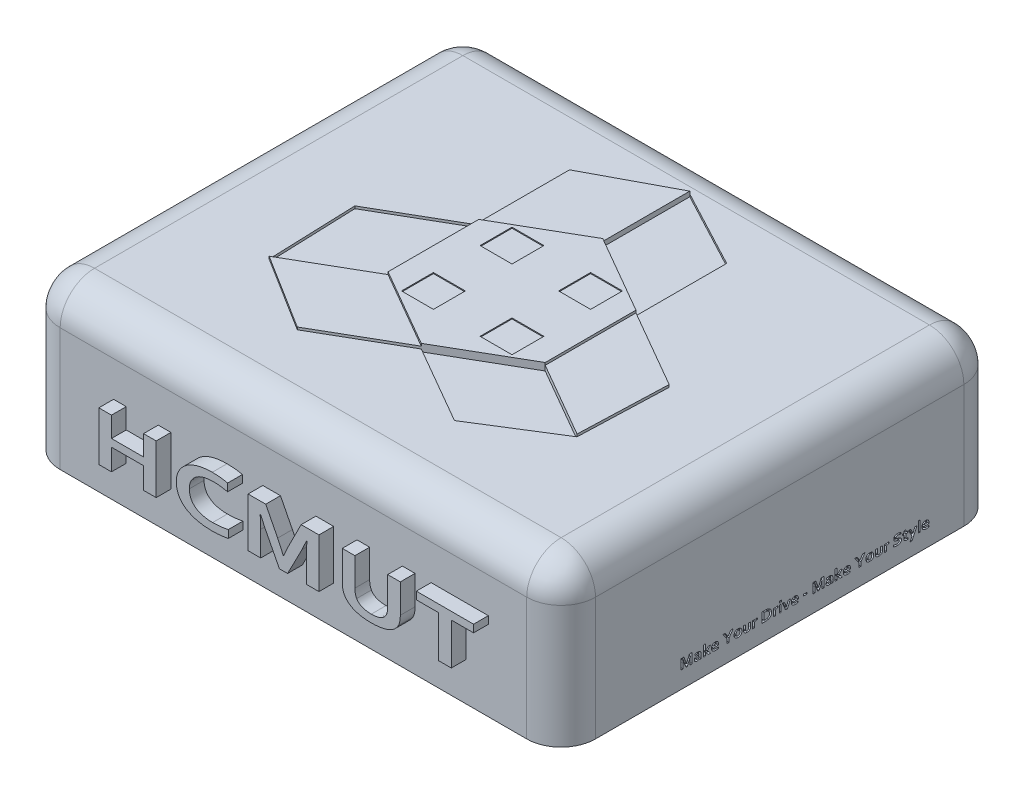
from build123d import *

# Parameters (mm, degrees)
SKETCH1_W           = 105
SKETCH1_H           = 85
BOSS_EXTRUDE1_DEPTH = 30
FILLET1_R           = 5
SHELL1_T            = 2
BOSS_EXTRUDE3_DEPTH = 1
BOSS_EXTRUDE4_DEPTH = 0.5
CUT_EXTRUDE2_DEPTH  = 0.5
CUT_EXTRUDE1_START  = 1
SKETCH3_W           = 6.5
SKETCH3_H           = 6.5
CUT_EXTRUDE1_DEPTH  = 0.2
BOSS_EXTRUDE2_DEPTH = 5
SKETCH8_W           = 0.640845071
SKETCH8_H           = 3.5
CUT_EXTRUDE3_DEPTH  = 1
SKETCH10_W          = 0.390168291
SKETCH10_H          = 1.448184234
SKETCH10_W_2        = 0.410097431
SKETCH10_H_2        = 0.383968114
SKETCH10_W_3        = 0.726306466
SKETCH10_H_3        = 0.321523472
SKETCH10_H_4        = 2.164304695
CUT_EXTRUDE4_DEPTH  = 0.5


with BuildPart() as part:
    # Sketch1 → Boss-Extrude1 (new body)
    with BuildSketch(Plane(origin=(0, 0, 0), x_dir=(1, 0, 0), z_dir=(0, 1, 0))):
        Rectangle(SKETCH1_W, SKETCH1_H)
    extrude(amount=BOSS_EXTRUDE1_DEPTH)

    # Fillet1
    fillet1_edges = [part.edges().sort_by_distance(p)[0] for p in [
        (-52.5, 30, 0),
        (0, 30, 42.5),
        (52.5, 30, 0),
        (52.5, 15, 42.5),
        (-52.5, 15, 42.5),
        (-52.5, 15, -42.5),
        (52.5, 15, -42.5),
        (0, 30, -42.5),
    ]]
    fillet(fillet1_edges, radius=FILLET1_R)

    # Shell1
    shell1_openings = [part.faces().sort_by_distance(p)[0] for p in [
        (0, 0, 0),
    ]]
    offset(amount=SHELL1_T, openings=shell1_openings, kind=Kind.INTERSECTION)

    # Sketch5 → Boss-Extrude3 (add)
    with BuildSketch(Plane(origin=(0, 32, 0), x_dir=(1, 0, 0), z_dir=(0, 1, 0))):
        Polygon((0, 18.475208614), (-16, 9.237604307), (-16, -9.237604307), (0, -18.475208614), (16, -9.237604307), (16, 9.237604307), align=None)
    extrude(amount=BOSS_EXTRUDE3_DEPTH)

    # Sketch6 → Boss-Extrude4 (add)
    with BuildSketch(Plane(origin=(0, 32, 0), x_dir=(1, 0, 0), z_dir=(0, 1, 0))):
        Polygon((-16, 9.237604307), (-16, 27.712812921), (0, 36.197935401), (0, 18.475208614), align=None)
        Polygon((16, 9.237604307), (32, 0), (31.348331622, -18.098967701), (16, -9.237604307), align=None)
        Polygon((0, -18.475208614), (-16, -27.712812921), (-31.348331622, -18.098967701), (-16, -9.237604307), align=None)
    extrude(amount=BOSS_EXTRUDE4_DEPTH)

    # Sketch7 → Cut-Extrude2 (cut)
    with BuildSketch(Plane(origin=(0, 32, 0), x_dir=(1, 0, 0), z_dir=(0, 1, 0))):
        Polygon((0, 36.197935401), (16, 27.712812921), (16, 9.237604307), (0, 18.475208614), align=None)
        Polygon((16, -9.237604307), (31.348331622, -18.098967701), (16, -27.712812921), (0, -18.475208614), align=None)
        Polygon((-31.348331622, -18.098967701), (-32, 0), (-16, 9.237604307), (-16, -9.237604307), align=None)
    extrude(amount=-CUT_EXTRUDE2_DEPTH, mode=Mode.SUBTRACT)

    # Sketch3 → Cut-Extrude1 (cut)
    with BuildSketch(Plane(origin=(0, 32, 0), x_dir=(1, 0, 0), z_dir=(0, 1, 0)).offset(CUT_EXTRUDE1_START)):
        with Locations((-8, 8)):
            Rectangle(SKETCH3_W, SKETCH3_H)
        with Locations((8, 8)):
            Rectangle(SKETCH3_W, SKETCH3_H)
        with Locations((-8, -8)):
            Rectangle(SKETCH3_W, SKETCH3_H)
        with Locations((8, -8)):
            Rectangle(SKETCH3_W, SKETCH3_H)
    extrude(amount=-CUT_EXTRUDE1_DEPTH, mode=Mode.SUBTRACT)

    # Sketch2 → Boss-Extrude2 (add)
    with BuildSketch(Plane(origin=(0, 0, 42.5), x_dir=(-1, 0, 0), z_dir=(0, 0, -1))):
        Polygon((34.046342609, 13.710310775), (27.525084858, 13.710310775), (27.525084858, 17.82899988), (24.947582644, 17.82899988), (24.947582644, 7.82899988), (27.525084858, 7.82899988), (27.525084858, 12.17798128), (34.046342609, 12.17798128), (34.046342609, 7.82899988), (36.623844823, 7.82899988), (36.623844823, 17.82899988), (34.046342609, 17.82899988), align=None)
        with BuildLine():
            add(Edge.make_bspline(
                [(13.380266435, 16.469389606), (13.552359048, 16.466557577), (13.889812418, 16.461004302), (14.386182263, 16.413037695), (14.862104098, 16.336702973), (15.315926474, 16.22868642), (15.74352714, 16.091108204), (16.144156369, 15.929621917), (16.510748714, 15.732798252), (16.84682654, 15.511655044), (17.15046279, 15.263034836), (17.418469073, 14.984514885), (17.648866302, 14.676172397), (17.848630969, 14.344152342), (18.002715764, 13.983122801), (18.117556883, 13.59880283), (18.184288021, 13.188574616), (18.192350835, 12.906743629), (18.19647547, 12.762569411)],
                knots=[0, 0, 0, 0, 1.208824721, 2.370363086, 3.499975917, 4.593000966, 5.644225365, 6.653463291, 7.62319839, 8.56239183, 9.476026064, 10.374598343, 11.270698205, 12.175176712, 13.09034024, 14.020672895, 14.987450101, 16, 16, 16, 16], degree=3))
            add(Edge.make_bspline(
                [(18.19647547, 12.762569411), (18.193033894, 12.619872673), (18.186312276, 12.341176802), (18.12283062, 11.937149442), (18.021426903, 11.559479571), (17.87934187, 11.208637253), (17.696259363, 10.887247101), (17.480084078, 10.59067779), (17.225130368, 10.325089699), (16.937853439, 10.08286517), (16.612778742, 9.87404055), (16.25519119, 9.691114952), (15.863965045, 9.537123703), (15.440432475, 9.408980079), (14.98499183, 9.309734645), (14.500150255, 9.241161202), (13.986435402, 9.194350067), (13.634289449, 9.190558463), (13.453339951, 9.188610155)],
                knots=[0, 0, 0, 0, 1.017787002, 1.987803215, 2.910447611, 3.803566063, 4.681075052, 5.543979129, 6.415888779, 7.302145385, 8.219723085, 9.166811349, 10.164580134, 11.216093557, 12.321700766, 13.487595825, 14.709006116, 16, 16, 16, 16], degree=3))
            add(Edge.make_bspline(
                [(13.453339951, 9.188610155), (13.183811724, 9.193058413), (12.639533549, 9.202041106), (11.959419436, 9.258246496), (11.417666223, 9.326017588), (11.021614483, 9.384900931), (10.638943367, 9.455519158), (10.38997312, 9.512515055), (10.266891767, 9.540691643)],
                knots=[0, 0, 0, 0, 1.510080338, 3.049416301, 3.82040259, 4.56905888, 5.292597526, 6, 6, 6, 6], degree=3))
            Line((10.266891767, 9.540691643), (10.266891767, 7.964075168))
            add(Edge.make_bspline(
                [(10.266891767, 7.964075168), (10.391524943, 7.939865596), (10.645407208, 7.890549825), (11.035185125, 7.826450889), (11.439868913, 7.771483977), (12.003197256, 7.708814399), (12.731993588, 7.656324592), (13.321855639, 7.647486293), (13.621630474, 7.642994566)],
                knots=[0, 0, 0, 0, 0.677016511, 1.379106996, 2.106099271, 2.854595634, 4.401468487, 6, 6, 6, 6], degree=3))
            add(Edge.make_bspline(
                [(13.621630474, 7.642994566), (13.768524258, 7.644640784), (14.057222757, 7.647876188), (14.484126537, 7.662400504), (14.896874587, 7.691570961), (15.297109105, 7.731423316), (15.683437999, 7.781770156), (16.057087758, 7.84416297), (16.416939158, 7.916526029), (16.763433486, 8.000656505), (17.095432051, 8.096514103), (17.41454731, 8.199256101), (17.718434977, 8.315237717), (18.008282193, 8.439585855), (18.286411128, 8.569545005), (18.550141091, 8.710604196), (18.79752751, 8.864824801), (19.034209679, 9.023519833), (19.254386192, 9.19403628), (19.461589955, 9.37188004), (19.654758454, 9.557363305), (19.831528045, 9.753163199), (19.996396237, 9.955097912), (20.147597286, 10.165225151), (20.281920227, 10.385241145), (20.445510591, 10.686565855), (20.611654411, 11.084229944), (20.752482643, 11.585502838), (20.842536139, 12.1098026), (20.852869558, 12.467691263), (20.858122945, 12.649637613)],
                knots=[0, 0, 0, 0, 1.247116152, 2.451026519, 3.625634648, 4.759176801, 5.865192752, 6.932435903, 7.974549036, 8.980660133, 9.958448909, 10.907628767, 11.825857429, 12.718588003, 13.584730544, 14.431410328, 15.25571979, 16.058674517, 16.84953293, 17.618235448, 18.376031643, 19.121262119, 19.8562266, 20.58830046, 21.316960492, 22.043110455, 23.497841644, 24.963664521, 26.456363067, 28, 28, 28, 28], degree=3))
            add(Edge.make_bspline(
                [(20.858122945, 12.649637613), (20.857305097, 12.744183808), (20.855685703, 12.931391637), (20.828731976, 13.209839995), (20.792663858, 13.483600048), (20.739227025, 13.752036738), (20.670251541, 14.014477682), (20.585950849, 14.271797336), (20.486074919, 14.524660567), (20.332751754, 14.854751105), (20.105024472, 15.251079255), (19.776375893, 15.694377209), (19.396522983, 16.106135917), (19.03598374, 16.416199533), (18.723650965, 16.648319872), (18.470240047, 16.81113255), (18.203965156, 16.967135358), (17.922588945, 17.112280223), (17.627874373, 17.250832927), (17.317333122, 17.375541731), (16.993755125, 17.494276679), (16.654665572, 17.598961486), (16.303739876, 17.69735477), (15.940117968, 17.780997692), (15.565623705, 17.85205499), (15.17983672, 17.908689753), (14.782691255, 17.956017038), (14.374204488, 17.988603228), (13.953975027, 18.008587291), (13.670367532, 18.012844375), (13.526413468, 18.015005195)],
                knots=[0, 0, 0, 0, 0.78066172, 1.545762753, 2.308893346, 3.061032479, 3.804921389, 4.549185022, 5.296464555, 6.049369425, 7.554351869, 9.062850271, 10.598896294, 12.17224551, 12.983202051, 13.811889239, 14.658945622, 15.531618842, 16.426336348, 17.347988971, 18.295026797, 19.272736757, 20.278634402, 21.305074449, 22.353818358, 23.426517721, 24.525409807, 25.657101891, 26.810787057, 28, 28, 28, 28], degree=3))
            add(Edge.make_bspline(
                [(13.526413468, 18.015005195), (13.236209008, 18.010873671), (12.670562909, 18.002820795), (11.97582356, 17.947300626), (11.448629354, 17.884709078), (11.078335914, 17.83034607), (10.72855054, 17.763577087), (10.502952993, 17.712265253), (10.393109659, 17.687281546)],
                knots=[0, 0, 0, 0, 1.654345232, 3.224533245, 3.970424303, 4.681019253, 5.357788928, 6, 6, 6, 6], degree=3))
            Line((10.393109659, 17.687281546), (10.393109659, 16.132808561))
            add(Edge.make_bspline(
                [(10.393109659, 16.132808561), (10.531004934, 16.162240383), (10.801003471, 16.219867804), (11.200243276, 16.293689256), (11.585176751, 16.350907599), (12.07565659, 16.409164344), (12.67211492, 16.4598234), (13.146169953, 16.466227267), (13.380266435, 16.469389606)],
                knots=[0, 0, 0, 0, 0.842570603, 1.64975073, 2.425754318, 3.167624933, 4.601324759, 6, 6, 6, 6], degree=3))
        make_face()
        with BuildLine():
            add(Edge.make_bspline(
                [(-0.997058631, 10.512790846), (-1.07812259, 10.713179533), (-1.244348883, 11.124088016), (-1.516008071, 11.747224289), (-1.819015204, 12.390609774), (-2.034080567, 12.824209788), (-2.144091404, 13.046006081)],
                knots=[0, 0, 0, 0, 0.93247545, 1.912094334, 2.931988649, 4, 4, 4, 4], degree=3))
            Line((-2.144091404, 13.046006081), (-4.573232236, 17.82899988))
            Line((-4.573232236, 17.82899988), (-8.191478472, 17.82899988))
            Line((-8.191478472, 17.82899988), (-8.191478472, 7.82899988))
            Line((-8.191478472, 7.82899988), (-5.613976258, 7.82899988))
            Line((-5.613976258, 7.82899988), (-5.613976258, 12.89543035))
            add(Edge.make_bspline(
                [(-5.613976258, 12.89543035), (-5.616175581, 13.088831487), (-5.620743327, 13.490503775), (-5.643014278, 14.115178543), (-5.683540695, 14.783990306), (-5.720902834, 15.244179148), (-5.74019415, 15.48178996)],
                knots=[0, 0, 0, 0, 0.896050858, 1.860996293, 2.89556121, 4, 4, 4, 4], degree=3))
            Line((-5.74019415, 15.48178996), (-5.647191492, 15.48178996))
            add(Edge.make_bspline(
                [(-5.647191492, 15.48178996), (-5.582823123, 15.33095534), (-5.445969807, 15.0102665), (-5.220669566, 14.516749915), (-4.981968521, 13.997661822), (-4.808226299, 13.65225025), (-4.721593618, 13.480018481)],
                knots=[0, 0, 0, 0, 0.89212518, 1.896743527, 2.951258115, 4, 4, 4, 4], degree=3))
            Line((-4.721593618, 13.480018481), (-1.807510359, 7.82899988))
            Line((-1.807510359, 7.82899988), (-0.144534274, 7.82899988))
            Line((-0.144534274, 7.82899988), (2.767334637, 13.480018481))
            add(Edge.make_bspline(
                [(2.767334637, 13.480018481), (2.85461477, 13.652287479), (3.029647489, 13.99775798), (3.271615483, 14.515716486), (3.493849558, 15.010326299), (3.629251406, 15.330981835), (3.692932511, 15.48178996)],
                knots=[0, 0, 0, 0, 1.050462234, 2.106610689, 3.109516416, 4, 4, 4, 4], degree=3))
            Line((3.692932511, 15.48178996), (3.788149517, 15.48178996))
            add(Edge.make_bspline(
                [(3.788149517, 15.48178996), (3.768772937, 15.255259951), (3.730741292, 14.810635115), (3.690435421, 14.154322559), (3.66848266, 13.521504301), (3.664086199, 13.107284419), (3.661931626, 12.904287746)],
                knots=[0, 0, 0, 0, 1.056870758, 2.074387367, 3.056315315, 4, 4, 4, 4], degree=3))
            Line((3.661931626, 12.904287746), (3.661931626, 7.82899988))
            Line((3.661931626, 7.82899988), (6.23943384, 7.82899988))
            Line((6.23943384, 7.82899988), (6.23943384, 17.82899988))
            Line((6.23943384, 17.82899988), (2.641116745, 17.82899988))
            Line((2.641116745, 17.82899988), (0.211975912, 13.06814957))
            add(Edge.make_bspline(
                [(0.211975912, 13.06814957), (0.110174551, 12.867326771), (-0.096017296, 12.460573626), (-0.382454483, 11.830537383), (-0.669280499, 11.182151045), (-0.845719987, 10.73778658), (-0.93505686, 10.512790846)],
                knots=[0, 0, 0, 0, 0.964094136, 1.952708172, 2.963391623, 4, 4, 4, 4], degree=3))
            Line((-0.93505686, 10.512790846), (-0.997058631, 10.512790846))
        make_face()
        with BuildLine():
            add(Edge.make_bspline(
                [(-18.819910713, 7.642994566), (-18.640510261, 7.644464223), (-18.290321929, 7.647332984), (-17.779032487, 7.676304887), (-17.295185337, 7.725002064), (-16.838461334, 7.790920296), (-16.40886331, 7.874284896), (-16.005873246, 7.976195947), (-15.629730577, 8.095786212), (-15.278111359, 8.229558129), (-14.95460456, 8.383971357), (-14.653197013, 8.548966446), (-14.37817505, 8.733529532), (-14.126840518, 8.933145621), (-13.900040419, 9.147476633), (-13.700701697, 9.378737894), (-13.518320663, 9.617968626), (-13.419499288, 9.791199428), (-13.37039787, 9.877272688)],
                knots=[0, 0, 0, 0, 1.393286401, 2.719684577, 3.975807384, 5.169244954, 6.302565003, 7.373208429, 8.395790287, 9.366753377, 10.292525518, 11.17788468, 12.033318949, 12.861501571, 13.66845861, 14.452611201, 15.231148283, 16, 16, 16, 16], degree=3))
            add(Edge.make_bspline(
                [(-13.37039787, 9.877272688), (-13.333784656, 9.948317492), (-13.259981362, 10.091526457), (-13.170049805, 10.318636303), (-13.094559667, 10.556130192), (-13.034532481, 10.805501035), (-12.990930899, 11.06830054), (-12.960094856, 11.34549783), (-12.942845393, 11.637460023), (-12.940035079, 11.83694977), (-12.938599818, 11.93883159)],
                knots=[0, 0, 0, 0, 0.900595546, 1.815380579, 2.749639273, 3.708333848, 4.704261703, 5.750938721, 6.851377269, 8, 8, 8, 8], degree=3))
            Line((-12.938599818, 11.93883159), (-12.938599818, 17.82899988))
            Line((-12.938599818, 17.82899988), (-15.516102033, 17.82899988))
            Line((-15.516102033, 17.82899988), (-15.516102033, 12.104907763))
            add(Edge.make_bspline(
                [(-15.516102033, 12.104907763), (-15.517733037, 12.018533374), (-15.520900062, 11.850814769), (-15.535126523, 11.606722639), (-15.564229462, 11.377562431), (-15.604704491, 11.162751832), (-15.651400301, 10.960582105), (-15.714199941, 10.774369118), (-15.786586485, 10.601995695), (-15.845802931, 10.496065419), (-15.874826568, 10.444146027)],
                knots=[0, 0, 0, 0, 1.206267346, 2.34228546, 3.412286205, 4.429092795, 5.394012001, 6.306596361, 7.170015503, 8, 8, 8, 8], degree=3))
            add(Edge.make_bspline(
                [(-15.874826568, 10.444146027), (-15.944679316, 10.33759202), (-16.08344396, 10.125919189), (-16.363097968, 9.864425922), (-16.679261672, 9.640489978), (-17.045658388, 9.472352057), (-17.448959765, 9.345858715), (-17.886428594, 9.253416534), (-18.357873669, 9.197505715), (-18.683200697, 9.191636053), (-18.850911599, 9.188610155)],
                knots=[0, 0, 0, 0, 0.901206553, 1.790274677, 2.697020631, 3.641313701, 4.636908028, 5.692016343, 6.810200242, 8, 8, 8, 8], degree=3))
            add(Edge.make_bspline(
                [(-18.850911599, 9.188610155), (-19.0186225, 9.191636053), (-19.343949528, 9.197505715), (-19.815394603, 9.253416534), (-20.252863432, 9.345858715), (-20.656164809, 9.472352057), (-21.022561526, 9.640489978), (-21.338725229, 9.864425922), (-21.618379237, 10.125919189), (-21.757143881, 10.33759202), (-21.82699663, 10.444146027)],
                knots=[0, 0, 0, 0, 1.189799758, 2.307983657, 3.363091972, 4.358686299, 5.302979369, 6.209725323, 7.098793447, 8, 8, 8, 8], degree=3))
            add(Edge.make_bspline(
                [(-21.82699663, 10.444146027), (-21.856003336, 10.496069378), (-21.915185238, 10.602007731), (-21.987844, 10.774317503), (-22.049577748, 10.960961036), (-22.100820423, 11.162116271), (-22.136545361, 11.377900305), (-22.167006379, 11.606662216), (-22.180838052, 11.850831369), (-22.184061237, 12.018539017), (-22.185721165, 12.104907763)],
                knots=[0, 0, 0, 0, 0.829917696, 1.693267345, 2.605778256, 3.573093405, 4.587988433, 5.657903059, 6.793829741, 8, 8, 8, 8], degree=3))
            Line((-22.185721165, 12.104907763), (-22.185721165, 17.82899988))
            Line((-22.185721165, 17.82899988), (-24.76100903, 17.82899988))
            Line((-24.76100903, 17.82899988), (-24.76100903, 11.93883159))
            add(Edge.make_bspline(
                [(-24.76100903, 11.93883159), (-24.759579746, 11.836948355), (-24.756781135, 11.637455838), (-24.739448083, 11.345513431), (-24.708907224, 11.068246271), (-24.66430634, 10.805857655), (-24.607958936, 10.555791297), (-24.531580707, 10.31868192), (-24.441888719, 10.091515357), (-24.368054088, 9.948313811), (-24.331425328, 9.877272688)],
                knots=[0, 0, 0, 0, 1.14889789, 2.249600053, 3.296527808, 4.292694242, 5.249702038, 6.184184538, 7.099188712, 8, 8, 8, 8], degree=3))
            add(Edge.make_bspline(
                [(-24.331425328, 9.877272688), (-24.281422186, 9.791304803), (-24.18098053, 9.618620516), (-23.999093984, 9.377972396), (-23.797150723, 9.147527373), (-23.568268118, 8.933168179), (-23.314445315, 8.732830817), (-23.035110378, 8.54916807), (-22.728505943, 8.382814136), (-22.397452805, 8.230227987), (-22.038846271, 8.095744965), (-21.655375963, 7.975845822), (-21.245533139, 7.874945532), (-20.810223347, 7.790815502), (-20.349765671, 7.725206882), (-19.863004732, 7.67627314), (-19.350233684, 7.647385713), (-18.999310209, 7.644480018), (-18.819910713, 7.642994566)],
                knots=[0, 0, 0, 0, 0.764907969, 1.536475931, 2.31735927, 3.121219458, 3.946440391, 4.803683504, 5.691067695, 6.62915027, 7.607341871, 8.637027877, 9.720128023, 10.854456474, 12.048456615, 13.298988179, 14.619185682, 16, 16, 16, 16], degree=3))
        make_face()
        Polygon((-35.141434185, 7.82899988), (-32.56614632, 7.82899988), (-32.56614632, 16.296670385), (-28.02230221, 16.296670385), (-28.02230221, 17.82899988), (-39.676420899, 17.82899988), (-39.676420899, 16.296670385), (-35.141434185, 16.296670385), align=None)
    extrude(amount=-BOSS_EXTRUDE2_DEPTH)

    # Sketch8 → Cut-Extrude3 (cut)
    # profile 1 of 5: a face of its own
    with BuildSketch(Plane(origin=(0, 0, -44.5), x_dir=(-1, 0, 0), z_dir=(0, 0, -1))):
        Polygon((25.887907015, 4.359277337), (24.525340994, 4.359277337), (24.195675501, 3.471953393), (23.517088353, 3.471953393), (24.908153494, 6.971953393), (25.498932543, 6.971953393), (26.89076793, 3.471953393), (26.216802261, 3.471953393), align=None)
        with BuildLine():
            add(Edge.make_bspline(
                [(25.181590994, 6.133925224), (25.164851416, 6.089013056), (25.132054297, 6.001018619), (25.084794594, 5.871594618), (25.037930071, 5.748529919), (24.995171938, 5.630353633), (24.953806217, 5.518067956), (24.913127492, 5.411941447), (24.876775567, 5.310875224), (24.852259063, 5.245802559), (24.840371804, 5.214250929)],
                knots=[0, 0, 0, 0, 1.172678974, 2.297578372, 3.370997112, 4.39445296, 5.372303269, 6.298679512, 7.175084723, 8, 8, 8, 8], degree=3))
            Line((24.840371804, 5.214250929), (24.725605078, 4.901530858))
            Line((24.725605078, 4.901530858), (25.68764293, 4.901530858))
            Line((25.68764293, 4.901530858), (25.572105958, 5.212710436))
            add(Edge.make_bspline(
                [(25.572105958, 5.212710436), (25.560299976, 5.244548945), (25.535925334, 5.310282762), (25.498329936, 5.411401023), (25.458878593, 5.518241106), (25.417503781, 5.63052137), (25.373177526, 5.748374665), (25.328328221, 5.872185469), (25.280136192, 6.001169001), (25.24755757, 6.088987588), (25.230886768, 6.133925224)],
                knots=[0, 0, 0, 0, 0.829583545, 1.712759004, 2.635583661, 3.611999971, 4.636127821, 5.71167343, 6.829040738, 8, 8, 8, 8], degree=3))
            Line((25.230886768, 6.133925224), (25.181590994, 6.133925224))
        make_face(mode=Mode.SUBTRACT)
    # profile 2 of 5: a face of its own
    with BuildSketch(Plane(origin=(0, 0, -44.5), x_dir=(-1, 0, 0), z_dir=(0, 0, -1))):
        with Locations((28.011168459, 5.221953393)):
            Rectangle(SKETCH8_W, SKETCH8_H)
    # profile 3 of 5: a face of its own
    with BuildSketch(Plane(origin=(0, 0, -44.5), x_dir=(-1, 0, 0), z_dir=(0, 0, -1))):
        Polygon((30.939337473, 3.471953393), (30.298492402, 3.471953393), (30.298492402, 6.429699872), (29.175473036, 6.429699872), (29.175473036, 6.971953393), (32.060046099, 6.971953393), (32.060046099, 6.429699872), (30.939337473, 6.429699872), align=None)
    # profile 4 of 5: a face of its own
    with BuildSketch(Plane(origin=(0, 0, -44.5), x_dir=(-1, 0, 0), z_dir=(0, 0, -1))):
        Polygon((33.547083951, 4.014206915), (35.257801381, 4.014206915), (35.257801381, 3.471953393), (32.906238881, 3.471953393), (32.906238881, 6.971953393), (35.163831311, 6.971953393), (35.163831311, 6.429699872), (33.547083951, 6.429699872), (33.547083951, 5.542375929), (34.935068106, 5.542375929), (34.935068106, 5.000122408), (33.547083951, 5.000122408), align=None)
    # profile 5 of 5: a face of its own
    with BuildSketch(Plane(origin=(0, 0, -44.5), x_dir=(-1, 0, 0), z_dir=(0, 0, -1))):
        Polygon((36.274988881, 3.471953393), (36.274988881, 6.971953393), (36.911982719, 6.971953393), (36.911982719, 5.379083675), (36.921995923, 5.379083675), (38.23526617, 6.971953393), (39.025539057, 6.971953393), (37.575164937, 5.237358323), (39.144927261, 3.471953393), (38.328465994, 3.471953393), (36.921995923, 5.051728922), (36.911982719, 5.051728922), (36.911982719, 3.471953393), align=None)
    extrude(amount=-CUT_EXTRUDE3_DEPTH, mode=Mode.SUBTRACT)

    # Sketch10 → Cut-Extrude4 (cut)
    # profile 1 of 28: a face of its own
    with BuildSketch(Plane(origin=(54.5, 0, 0), x_dir=(0, 0, -1), z_dir=(1, 0, 0))):
        with BuildLine():
            add(Edge.make_bspline(
                [(-18.939327833, 3.96134576), (-18.926842028, 4.001420288), (-18.901260093, 4.083528242), (-18.858076251, 4.207834201), (-18.811105616, 4.336776816), (-18.777259096, 4.423618133), (-18.759965566, 4.467988807)],
                knots=[0, 0, 0, 0, 0.936892489, 1.91958158, 2.937031698, 4, 4, 4, 4], degree=3))
            Line((-18.759965566, 4.467988807), (-18.379540411, 5.424587567))
            Line((-18.379540411, 5.424587567), (-17.813109941, 5.424587567))
            Line((-17.813109941, 5.424587567), (-17.813109941, 3.424587567))
            Line((-17.813109941, 3.424587567), (-18.216564326, 3.424587567))
            Line((-18.216564326, 3.424587567), (-18.216564326, 4.437873661))
            add(Edge.make_bspline(
                [(-18.216564326, 4.437873661), (-18.216253805, 4.476553121), (-18.215608946, 4.556878691), (-18.211942079, 4.681790373), (-18.205768821, 4.815558617), (-18.199744942, 4.907619976), (-18.196635185, 4.955145583)],
                knots=[0, 0, 0, 0, 0.896493615, 1.861746784, 2.896151612, 4, 4, 4, 4], degree=3))
            Line((-18.196635185, 4.955145583), (-18.211692758, 4.955145583))
            add(Edge.make_bspline(
                [(-18.211692758, 4.955145583), (-18.221808412, 4.92500622), (-18.243273902, 4.861050277), (-18.278119671, 4.762138355), (-18.31559225, 4.658556443), (-18.342913621, 4.589272955), (-18.356511181, 4.554791287)],
                knots=[0, 0, 0, 0, 0.895946555, 1.901204933, 2.955451653, 4, 4, 4, 4], degree=3))
            Line((-18.356511181, 4.554791287), (-18.812667071, 3.424587567))
            Line((-18.812667071, 3.424587567), (-19.073074512, 3.424587567))
            Line((-19.073074512, 3.424587567), (-19.529230402, 4.554791287))
            add(Edge.make_bspline(
                [(-19.529230402, 4.554791287), (-19.542771374, 4.58929352), (-19.569997653, 4.658665748), (-19.608315223, 4.761943093), (-19.64233799, 4.861147509), (-19.663886654, 4.925022613), (-19.674048825, 4.955145583)],
                knots=[0, 0, 0, 0, 1.044531158, 2.100196099, 3.104068189, 4, 4, 4, 4], degree=3))
            Line((-19.674048825, 4.955145583), (-19.689106398, 4.955145583))
            add(Edge.make_bspline(
                [(-19.689106398, 4.955145583), (-19.685984028, 4.90983546), (-19.679854174, 4.82088238), (-19.673715695, 4.689617247), (-19.670097737, 4.563078855), (-19.669480013, 4.48024373), (-19.669177258, 4.43964514)],
                knots=[0, 0, 0, 0, 1.056212038, 2.073561203, 3.055826879, 4, 4, 4, 4], degree=3))
            Line((-19.669177258, 4.43964514), (-19.669177258, 3.424587567))
            Line((-19.669177258, 3.424587567), (-20.072631642, 3.424587567))
            Line((-20.072631642, 3.424587567), (-20.072631642, 5.424587567))
            Line((-20.072631642, 5.424587567), (-19.509301261, 5.424587567))
            Line((-19.509301261, 5.424587567), (-19.128876106, 4.472417505))
            add(Edge.make_bspline(
                [(-19.128876106, 4.472417505), (-19.113026216, 4.432192629), (-19.080826117, 4.350473131), (-19.035669516, 4.224793837), (-18.990918571, 4.094911428), (-18.963449511, 4.006300222), (-18.949513839, 3.96134576)],
                knots=[0, 0, 0, 0, 0.957556101, 1.945338562, 2.957623966, 4, 4, 4, 4], degree=3))
            Line((-18.949513839, 3.96134576), (-18.939327833, 3.96134576))
        make_face()
    # profile 2 of 28: a face of its own
    with BuildSketch(Plane(origin=(54.5, 0, 0), x_dir=(0, 0, -1), z_dir=(1, 0, 0))):
        with BuildLine():
            Line((-16.377326062, 3.578706256), (-16.383969109, 3.578706256))
            add(Edge.make_bspline(
                [(-16.383969109, 3.578706256), (-16.395770725, 3.567893935), (-16.420858192, 3.544909476), (-16.463679986, 3.512640183), (-16.513004176, 3.480533966), (-16.568921649, 3.450546477), (-16.631762043, 3.424187518), (-16.701091288, 3.403474068), (-16.77685079, 3.38966005), (-16.829433405, 3.388159317), (-16.856511181, 3.387386504)],
                knots=[0, 0, 0, 0, 0.735131266, 1.562716634, 2.460185603, 3.437375182, 4.474171374, 5.585839666, 6.756811681, 8, 8, 8, 8], degree=3))
            add(Edge.make_bspline(
                [(-16.856511181, 3.387386504), (-16.875122937, 3.387886249), (-16.911843366, 3.38887223), (-16.966113494, 3.394463451), (-17.018433069, 3.404928871), (-17.068886829, 3.418412056), (-17.116671953, 3.435820326), (-17.160695246, 3.457969247), (-17.201736165, 3.482585013), (-17.239147093, 3.511115664), (-17.272837856, 3.543037327), (-17.302906483, 3.578241064), (-17.328347587, 3.617045045), (-17.350825859, 3.658301237), (-17.36867005, 3.702662792), (-17.380830132, 3.749875359), (-17.388650995, 3.799439492), (-17.389656093, 3.833326143), (-17.390169286, 3.850628311)],
                knots=[0, 0, 0, 0, 1.12632461, 2.222204318, 3.296021518, 4.35125216, 5.379951856, 6.366610364, 7.328622053, 8.271874054, 9.206970985, 10.132204201, 11.066148615, 12.009273735, 12.971285425, 13.950557992, 14.953576387, 16, 16, 16, 16], degree=3))
            add(Edge.make_bspline(
                [(-17.390169286, 3.850628311), (-17.389559775, 3.869558675), (-17.388362448, 3.906745604), (-17.379381506, 3.960869285), (-17.364676131, 4.01200986), (-17.344199955, 4.060001652), (-17.318423009, 4.104848482), (-17.287828469, 4.146207098), (-17.252288778, 4.183588652), (-17.2128981, 4.218086313), (-17.16823653, 4.247914609), (-17.11988786, 4.274678165), (-17.067334, 4.297217572), (-17.010866027, 4.315819648), (-16.950833046, 4.330165924), (-16.887539584, 4.340960539), (-16.82120179, 4.347056787), (-16.775920806, 4.347956265), (-16.752879649, 4.348413962)],
                knots=[0, 0, 0, 0, 0.999777658, 1.963969637, 2.889569806, 3.805093543, 4.713447053, 5.616596018, 6.51593172, 7.433777861, 8.376922041, 9.347308002, 10.349880377, 11.393126023, 12.484583418, 13.607763455, 14.782714201, 16, 16, 16, 16], degree=3))
            add(Edge.make_bspline(
                [(-16.752879649, 4.348413962), (-16.719489186, 4.347882586), (-16.655534719, 4.346864813), (-16.564362013, 4.337493401), (-16.48283541, 4.325267523), (-16.432332565, 4.3135703), (-16.408769817, 4.308112811)],
                knots=[0, 0, 0, 0, 1.153438305, 2.209239536, 3.164497844, 4, 4, 4, 4], degree=3))
            Line((-16.408769817, 4.308112811), (-16.408769817, 4.366128754))
            add(Edge.make_bspline(
                [(-16.408769817, 4.366128754), (-16.40970915, 4.382915918), (-16.411580427, 4.416358191), (-16.424138987, 4.456690974), (-16.437962542, 4.487389356), (-16.451724866, 4.509249299), (-16.469039214, 4.529152271), (-16.488338811, 4.548483093), (-16.511373896, 4.565591622), (-16.536905257, 4.581980971), (-16.566652517, 4.594694157), (-16.598779365, 4.607066466), (-16.634781752, 4.616111698), (-16.674092378, 4.623335098), (-16.717228586, 4.627130507), (-16.747116119, 4.627613968), (-16.762622785, 4.627864804)],
                knots=[0, 0, 0, 0, 1.418866599, 2.826571724, 3.542306351, 4.266932432, 5.002999278, 5.771860661, 6.574220348, 7.427336305, 8.333366737, 9.306068585, 10.3397219, 11.46980949, 12.687251301, 14, 14, 14, 14], degree=3))
            add(Edge.make_bspline(
                [(-16.762622785, 4.627864804), (-16.802259416, 4.626844364), (-16.881946742, 4.624792824), (-16.981084734, 4.60850139), (-17.061398066, 4.590814858), (-17.124303689, 4.57431176), (-17.189900557, 4.554866571), (-17.234179165, 4.539882218), (-17.256865477, 4.532204928)],
                knots=[0, 0, 0, 0, 1.409623761, 2.833973096, 3.565641269, 4.336563103, 5.147731835, 6, 6, 6, 6], degree=3))
            Line((-17.256865477, 4.532204928), (-17.256865477, 4.808555681))
            add(Edge.make_bspline(
                [(-17.256865477, 4.808555681), (-17.236576424, 4.816321355), (-17.195786179, 4.831933901), (-17.132535084, 4.851213766), (-17.067651842, 4.867992992), (-17.001007287, 4.882126806), (-16.932814223, 4.893942234), (-16.862682562, 4.901500659), (-16.791054457, 4.907152361), (-16.742704866, 4.9081443), (-16.718335805, 4.908644255)],
                knots=[0, 0, 0, 0, 0.946344172, 1.902583174, 2.879222127, 3.865787577, 4.87038954, 5.893276302, 6.938173475, 8, 8, 8, 8], degree=3))
            add(Edge.make_bspline(
                [(-16.718335805, 4.908644255), (-16.690118054, 4.908337224), (-16.635345496, 4.907741257), (-16.556091474, 4.899792731), (-16.482071512, 4.88838994), (-16.413782844, 4.870840643), (-16.350722796, 4.849649545), (-16.292963717, 4.825013989), (-16.240548031, 4.796479787), (-16.193621206, 4.764284874), (-16.15211091, 4.728582121), (-16.11575065, 4.689970916), (-16.085621666, 4.647680368), (-16.061079314, 4.602562558), (-16.04207295, 4.555093714), (-16.028299928, 4.505507971), (-16.019504327, 4.453834774), (-16.018611705, 4.418570753), (-16.018158657, 4.400672598)],
                knots=[0, 0, 0, 0, 1.393330348, 2.704548112, 3.930998721, 5.089484844, 6.18257046, 7.214802852, 8.187323669, 9.125895881, 10.020489494, 10.887337696, 11.739303942, 12.577964523, 13.418904767, 14.259338953, 15.116532416, 16, 16, 16, 16], degree=3))
            Line((-16.018158657, 4.400672598), (-16.018158657, 3.855057009))
            add(Edge.make_bspline(
                [(-16.018158657, 3.855057009), (-16.018248441, 3.832027142), (-16.018421687, 3.787589272), (-16.017222701, 3.723377433), (-16.016545875, 3.664174638), (-16.014802088, 3.593895874), (-16.011565636, 3.514641118), (-16.009422519, 3.453375003), (-16.008415521, 3.424587567)],
                knots=[0, 0, 0, 0, 0.962629604, 1.857466589, 2.684432831, 3.437486121, 4.795937951, 6, 6, 6, 6], degree=3))
            Line((-16.008415521, 3.424587567), (-16.360939879, 3.424587567))
            Line((-16.360939879, 3.424587567), (-16.377326062, 3.578706256))
        make_face()
        with BuildLine():
            add(Edge.make_bspline(
                [(-16.408769817, 4.041948063), (-16.428667882, 4.045968189), (-16.471245243, 4.054570349), (-16.538352146, 4.064094407), (-16.610079163, 4.07246626), (-16.659112898, 4.073081942), (-16.683791961, 4.073391819)],
                knots=[0, 0, 0, 0, 0.878287554, 1.879336848, 2.932653636, 4, 4, 4, 4], degree=3))
            add(Edge.make_bspline(
                [(-16.683791961, 4.073391819), (-16.706416961, 4.072901047), (-16.749393217, 4.071968824), (-16.810320731, 4.062225963), (-16.863833922, 4.046108843), (-16.909887275, 4.023761449), (-16.947375698, 3.994347637), (-16.974686201, 3.957149366), (-16.990586921, 3.912496558), (-16.992407497, 3.880577888), (-16.993357948, 3.863914405)],
                knots=[0, 0, 0, 0, 1.287362421, 2.445348772, 3.500846768, 4.459387373, 5.344146837, 6.186444208, 7.053213795, 8, 8, 8, 8], degree=3))
            add(Edge.make_bspline(
                [(-16.993357948, 3.863914405), (-16.992511663, 3.848431526), (-16.990892412, 3.818807154), (-16.976156783, 3.777909806), (-16.953431402, 3.743919047), (-16.923955427, 3.716278695), (-16.888301275, 3.695633064), (-16.848061198, 3.680493216), (-16.803881022, 3.671808377), (-16.773287895, 3.670567574), (-16.757751217, 3.669937434)],
                knots=[0, 0, 0, 0, 1.079920795, 2.066280759, 2.997076705, 3.917562473, 4.866791811, 5.860261156, 6.913336556, 8, 8, 8, 8], degree=3))
            add(Edge.make_bspline(
                [(-16.757751217, 3.669937434), (-16.738502678, 3.670563363), (-16.700733643, 3.671791544), (-16.646271973, 3.683004423), (-16.595651865, 3.698959095), (-16.549074215, 3.719007091), (-16.506670194, 3.741835886), (-16.469026412, 3.767124362), (-16.436571587, 3.793259718), (-16.417647011, 3.811811053), (-16.408769817, 3.820513165)],
                knots=[0, 0, 0, 0, 1.18363275, 2.32249661, 3.408920594, 4.447065787, 5.43924693, 6.369302988, 7.235068108, 8, 8, 8, 8], degree=3))
            Line((-16.408769817, 3.820513165), (-16.408769817, 4.041948063))
        make_face(mode=Mode.SUBTRACT)
    # profile 3 of 28: a face of its own
    with BuildSketch(Plane(origin=(54.5, 0, 0), x_dir=(0, 0, -1), z_dir=(1, 0, 0))):
        Polygon((-15.542073626, 5.588892262), (-15.151905335, 5.588892262), (-15.151905335, 4.285526451), (-15.143490809, 4.285526451), (-14.535873449, 4.872771801), (-14.053588241, 4.872771801), (-14.753322519, 4.192966664), (-14.048273803, 3.424587567), (-14.521258746, 3.424587567), (-15.145262289, 4.098635397), (-15.151905335, 4.098635397), (-15.151905335, 3.424587567), (-15.542073626, 3.424587567), align=None)
    # profile 4 of 28: a face of its own
    with BuildSketch(Plane(origin=(54.5, 0, 0), x_dir=(0, 0, -1), z_dir=(1, 0, 0))):
        with BuildLine():
            add(Edge.make_bspline(
                [(-12.979628985, 3.672594653), (-12.940755429, 3.673693863), (-12.861242248, 3.675942222), (-12.740299239, 3.692322235), (-12.616297024, 3.717709055), (-12.533810972, 3.741559081), (-12.492029339, 3.753639826)],
                knots=[0, 0, 0, 0, 0.94030663, 1.923332473, 2.948106288, 4, 4, 4, 4], degree=3))
            Line((-12.492029339, 3.753639826), (-12.492029339, 3.471088896))
            add(Edge.make_bspline(
                [(-12.492029339, 3.471088896), (-12.506272876, 3.465828298), (-12.537726443, 3.454211481), (-12.591173952, 3.440941296), (-12.654284044, 3.426522027), (-12.726062532, 3.413201569), (-12.803608459, 3.401886451), (-12.883962688, 3.393358163), (-12.965839845, 3.388517999), (-13.020957426, 3.387765494), (-13.048716673, 3.387386504)],
                knots=[0, 0, 0, 0, 0.644092839, 1.422330471, 2.334464592, 3.392659427, 4.519903541, 5.660342372, 6.821662096, 8, 8, 8, 8], degree=3))
            add(Edge.make_bspline(
                [(-13.048716673, 3.387386504), (-13.076630156, 3.387966828), (-13.131807483, 3.389113969), (-13.213654067, 3.396145148), (-13.293214097, 3.408624643), (-13.370462424, 3.425633421), (-13.444107553, 3.448334362), (-13.513437489, 3.477292722), (-13.577918365, 3.512349575), (-13.637557594, 3.553503095), (-13.691631593, 3.601408738), (-13.740099145, 3.655543256), (-13.782394812, 3.716480442), (-13.818967809, 3.783672717), (-13.848690303, 3.858104658), (-13.86826376, 3.940475027), (-13.881769691, 4.029841568), (-13.882926892, 4.092084517), (-13.883526239, 4.124321845)],
                knots=[0, 0, 0, 0, 1.058305394, 2.091980517, 3.111498381, 4.109482306, 5.088389468, 6.029064677, 6.953211953, 7.866088614, 8.770086703, 9.685704228, 10.614162901, 11.575831479, 12.5808213, 13.64230362, 14.778884462, 16, 16, 16, 16], degree=3))
            add(Edge.make_bspline(
                [(-13.883526239, 4.124321845), (-13.882777886, 4.156245277), (-13.881327955, 4.218096766), (-13.869662774, 4.307853985), (-13.850465504, 4.391525997), (-13.822816056, 4.46891303), (-13.788550367, 4.539685677), (-13.749558622, 4.604690476), (-13.704565521, 4.662992533), (-13.654321785, 4.71490815), (-13.59966022, 4.760741789), (-13.540751873, 4.80027001), (-13.478324827, 4.834190793), (-13.412022937, 4.860950413), (-13.343661992, 4.881999058), (-13.273851779, 4.897863261), (-13.202769732, 4.906708811), (-13.155028131, 4.907997903), (-13.131090455, 4.908644255)],
                knots=[0, 0, 0, 0, 1.253607499, 2.428858214, 3.548474268, 4.61958822, 5.649230253, 6.632773698, 7.591964675, 8.535177443, 9.465467895, 10.388628606, 11.317454046, 12.251063882, 13.191974452, 14.124719501, 15.05973291, 16, 16, 16, 16], degree=3))
            add(Edge.make_bspline(
                [(-13.131090455, 4.908644255), (-13.106264578, 4.908169096), (-13.057514259, 4.907236031), (-12.98605103, 4.89885561), (-12.917468461, 4.886447559), (-12.852200221, 4.867546436), (-12.790192938, 4.844123772), (-12.73240625, 4.814066979), (-12.678949489, 4.778095867), (-12.630109598, 4.735801329), (-12.585753912, 4.687525501), (-12.546612841, 4.632670092), (-12.513043909, 4.571161568), (-12.484646379, 4.503521905), (-12.462025511, 4.429513162), (-12.445806756, 4.349000081), (-12.435983385, 4.261855775), (-12.434976715, 4.201555601), (-12.434456265, 4.170380304)],
                knots=[0, 0, 0, 0, 1.029673383, 2.021959, 2.981803903, 3.918223809, 4.837315898, 5.727670804, 6.614457986, 7.504707543, 8.402092643, 9.328442359, 10.293413436, 11.303591328, 12.367262713, 13.498833044, 14.70689222, 16, 16, 16, 16], degree=3))
            add(Edge.make_bspline(
                [(-12.434456265, 4.170380304), (-12.435108496, 4.147347732), (-12.436308725, 4.104963365), (-12.438381465, 4.062612961), (-12.439327833, 4.043276673)],
                knots=[0, 0, 0, 0, 1.086842829, 2, 2, 2, 2], degree=3))
            Line((-12.439327833, 4.043276673), (-13.485386292, 4.043276673))
            add(Edge.make_bspline(
                [(-13.485386292, 4.043276673), (-13.483715356, 4.027118382), (-13.480480764, 3.995839227), (-13.469244273, 3.951206401), (-13.455638172, 3.909733351), (-13.436677956, 3.872293378), (-13.414306446, 3.838465156), (-13.38912066, 3.807503128), (-13.359982299, 3.780632059), (-13.328288753, 3.756305012), (-13.293328158, 3.735539707), (-13.255182639, 3.718561694), (-13.215033124, 3.703081714), (-13.156436046, 3.688017909), (-13.077760495, 3.675017424), (-13.013054482, 3.673419896), (-12.979628985, 3.672594653)],
                knots=[0, 0, 0, 0, 0.97078166, 1.879235262, 2.748040886, 3.577655364, 4.381278203, 5.171880894, 5.959318788, 6.747301535, 7.559328376, 8.385455281, 9.243596983, 10.130712103, 12.001223261, 14, 14, 14, 14], degree=3))
        make_face()
        with BuildLine():
            add(Edge.make_bspline(
                [(-13.135962023, 4.632293502), (-13.148092631, 4.632157907), (-13.171575799, 4.631895414), (-13.205717748, 4.626424389), (-13.238028361, 4.619545275), (-13.277169315, 4.604327805), (-13.322533774, 4.580721207), (-13.368783382, 4.541710291), (-13.406555569, 4.494699926), (-13.435618273, 4.441195668), (-13.45680868, 4.38243744), (-13.463725785, 4.341036082), (-13.46722863, 4.320070295)],
                knots=[0, 0, 0, 0, 0.724375435, 1.402290008, 2.063973461, 2.695279245, 3.907828312, 5.104820245, 6.284994087, 7.494003045, 8.73095474, 10, 10, 10, 10], degree=3))
            Line((-13.46722863, 4.320070295), (-12.839682129, 4.320070295))
            add(Edge.make_bspline(
                [(-12.839682129, 4.320070295), (-12.840594598, 4.340976637), (-12.842383373, 4.381960772), (-12.857086415, 4.440725631), (-12.87959656, 4.494781821), (-12.91322016, 4.541384927), (-12.955148153, 4.581115523), (-12.99835386, 4.604454111), (-13.035962939, 4.619456298), (-13.067358191, 4.626541297), (-13.100792663, 4.631877215), (-13.123980055, 4.632151676), (-13.135962023, 4.632293502)],
                knots=[0, 0, 0, 0, 1.292304618, 2.533393341, 3.728418445, 4.894732167, 6.065083629, 7.272135408, 7.908489812, 8.566708214, 9.25935368, 10, 10, 10, 10], degree=3))
        make_face(mode=Mode.SUBTRACT)
    # profile 5 of 28: a face of its own
    with BuildSketch(Plane(origin=(54.5, 0, 0), x_dir=(0, 0, -1), z_dir=(1, 0, 0))):
        Polygon((-10.505758303, 4.563648683), (-9.919398692, 5.424587567), (-9.471657328, 5.424587567), (-10.306466894, 4.230167727), (-10.306466894, 3.424587567), (-10.709921279, 3.424587567), (-10.709921279, 4.230167727), (-11.545173715, 5.424587567), (-11.096989481, 5.424587567), (-10.51062987, 4.563648683), align=None)
    # profile 6 of 28: a face of its own
    with BuildSketch(Plane(origin=(54.5, 0, 0), x_dir=(0, 0, -1), z_dir=(1, 0, 0))):
        with BuildLine():
            add(Edge.make_bspline(
                [(-7.687777789, 4.148236814), (-7.688415641, 4.120444404), (-7.68966905, 4.065831022), (-7.700813081, 3.985839987), (-7.71756295, 3.90923845), (-7.742769328, 3.837047829), (-7.773473418, 3.769019568), (-7.811100884, 3.706291048), (-7.854156325, 3.648024382), (-7.904045468, 3.595573721), (-7.95896426, 3.547639114), (-8.020307219, 3.506576258), (-8.086484342, 3.470474289), (-8.15801168, 3.440453995), (-8.234291252, 3.416355986), (-8.315201635, 3.399888497), (-8.400373662, 3.389361338), (-8.458634151, 3.38805557), (-8.488486381, 3.387386504)],
                knots=[0, 0, 0, 0, 1.071070023, 2.104702516, 3.108583595, 4.089612818, 5.047312692, 5.981516814, 6.904766857, 7.834939274, 8.767199233, 9.709707248, 10.675039257, 11.669842588, 12.695987855, 13.754276881, 14.849308624, 16, 16, 16, 16], degree=3))
            add(Edge.make_bspline(
                [(-8.488486381, 3.387386504), (-8.519076211, 3.388052606), (-8.578660657, 3.389350073), (-8.665602175, 3.399858509), (-8.747851123, 3.416296787), (-8.825013219, 3.440408093), (-8.896950741, 3.470245689), (-8.962929017, 3.506731083), (-9.024148273, 3.547519992), (-9.078726328, 3.595432854), (-9.127631284, 3.648337465), (-9.170844428, 3.706131982), (-9.207851528, 3.769082596), (-9.238366251, 3.83696099), (-9.262222607, 3.909425066), (-9.279481794, 3.985776713), (-9.289787584, 4.065876827), (-9.291155714, 4.120453406), (-9.291852191, 4.148236814)],
                knots=[0, 0, 0, 0, 1.174930431, 2.288589955, 3.359771744, 4.393090767, 5.389578507, 6.346493387, 7.285644764, 8.210297933, 9.129420319, 10.04938231, 10.977369325, 11.929312748, 12.903221525, 13.903527394, 14.932744474, 16, 16, 16, 16], degree=3))
            add(Edge.make_bspline(
                [(-9.291852191, 4.148236814), (-9.291215553, 4.176028151), (-9.289967882, 4.230493032), (-9.278871667, 4.310213018), (-9.261851416, 4.386379029), (-9.237456562, 4.458648399), (-9.206423587, 4.52661793), (-9.169152367, 4.58970824), (-9.125852513, 4.647810478), (-9.076490311, 4.700787341), (-9.021148288, 4.748070577), (-8.960183028, 4.789623036), (-8.894008799, 4.825527267), (-8.822509089, 4.855578632), (-8.746090029, 4.879742637), (-8.665007693, 4.896087967), (-8.57970111, 4.906679215), (-8.52143935, 4.907978507), (-8.491586469, 4.908644255)],
                knots=[0, 0, 0, 0, 1.071528018, 2.099958262, 3.098715908, 4.078329197, 5.036438589, 5.975938825, 6.899583654, 7.826260312, 8.76323756, 9.701442589, 10.667187379, 11.662416093, 12.689000146, 13.753316597, 14.848816581, 16, 16, 16, 16], degree=3))
            add(Edge.make_bspline(
                [(-8.491586469, 4.908644255), (-8.460996303, 4.907979362), (-8.401411204, 4.90668425), (-8.314474334, 4.896159069), (-8.232347199, 4.87980824), (-8.155373018, 4.855549411), (-8.08348277, 4.825670423), (-8.017218031, 4.789432383), (-7.955934436, 4.748494297), (-7.901340146, 4.700604612), (-7.85245726, 4.647682772), (-7.809095183, 4.589832257), (-7.772314777, 4.526588872), (-7.741802591, 4.458550243), (-7.717346809, 4.386385347), (-7.700176152, 4.310248489), (-7.689814579, 4.230454277), (-7.688466106, 4.176021551), (-7.687777789, 4.148236814)],
                knots=[0, 0, 0, 0, 1.175290503, 2.289291321, 3.360801387, 4.389019906, 5.385813032, 6.348001903, 7.287441095, 8.212377635, 9.131781697, 10.052025622, 10.985190758, 11.937425915, 12.91343222, 13.908512391, 14.9324174, 16, 16, 16, 16], degree=3))
        make_face()
        with BuildLine():
            add(Edge.make_bspline(
                [(-8.091675043, 4.148236814), (-8.091947489, 4.166855267), (-8.092476497, 4.203006711), (-8.098507174, 4.25554643), (-8.107556249, 4.30476874), (-8.120555961, 4.350638338), (-8.136387469, 4.393223773), (-8.155263327, 4.43241302), (-8.177840159, 4.467572016), (-8.202344518, 4.499839096), (-8.230626864, 4.527587035), (-8.260799471, 4.552509558), (-8.294384199, 4.572795131), (-8.330233757, 4.589494972), (-8.367992082, 4.602998904), (-8.407694974, 4.612072138), (-8.449029612, 4.618165773), (-8.477244342, 4.618723768), (-8.491586469, 4.619007408)],
                knots=[0, 0, 0, 0, 1.279420327, 2.484250109, 3.630774606, 4.71676682, 5.757325663, 6.751359551, 7.700224772, 8.625957529, 9.530188786, 10.417807191, 11.310747651, 12.218786933, 13.133606938, 14.061673338, 15.014708701, 16, 16, 16, 16], degree=3))
            add(Edge.make_bspline(
                [(-8.491586469, 4.619007408), (-8.50563286, 4.618716456), (-8.53340504, 4.618141193), (-8.574156825, 4.612085638), (-8.613538726, 4.602919354), (-8.651042032, 4.589563637), (-8.686554409, 4.572957382), (-8.719401528, 4.552064978), (-8.749891535, 4.52792655), (-8.777689614, 4.499645927), (-8.802253569, 4.467599761), (-8.82483273, 4.432416628), (-8.843584479, 4.393129162), (-8.86005509, 4.350737393), (-8.873057491, 4.304805903), (-8.881415986, 4.255493887), (-8.887638176, 4.203013794), (-8.888139578, 4.166857675), (-8.888397807, 4.148236814)],
                knots=[0, 0, 0, 0, 0.968892017, 1.915669702, 2.837554141, 3.756053437, 4.658530007, 5.537753924, 6.436887763, 7.337579244, 8.267035181, 9.219716618, 10.217748385, 11.266113531, 12.356473469, 13.50575855, 14.715434006, 16, 16, 16, 16], degree=3))
            add(Edge.make_bspline(
                [(-8.888397807, 4.148236814), (-8.888130935, 4.129617001), (-8.887610647, 4.093316094), (-8.881467999, 4.040677035), (-8.87298162, 3.991095995), (-8.860178563, 3.945114915), (-8.843711583, 3.902747205), (-8.824138066, 3.864123558), (-8.802035385, 3.828740982), (-8.776596506, 3.797261869), (-8.748759717, 3.76905864), (-8.717754794, 3.745214522), (-8.684889991, 3.72409155), (-8.649390856, 3.706784272), (-8.611555303, 3.693646108), (-8.572150736, 3.683849711), (-8.530889614, 3.677878623), (-8.502826029, 3.677312581), (-8.488486381, 3.677023351)],
                knots=[0, 0, 0, 0, 1.280071212, 2.495607554, 3.64087121, 4.737193517, 5.772421991, 6.762389436, 7.711737377, 8.636269739, 9.54096101, 10.43065493, 11.320812293, 12.224534302, 13.139819708, 14.070742603, 15.014207449, 16, 16, 16, 16], degree=3))
            add(Edge.make_bspline(
                [(-8.488486381, 3.677023351), (-8.474296607, 3.677330619), (-8.446238871, 3.677938187), (-8.405096048, 3.683743987), (-8.36585908, 3.693661083), (-8.32844402, 3.706763474), (-8.293338239, 3.724230565), (-8.260588016, 3.745073118), (-8.229991993, 3.769096903), (-8.202549159, 3.797253913), (-8.177651628, 3.828895147), (-8.155410212, 3.863999527), (-8.136376748, 3.902783814), (-8.120394742, 3.945195651), (-8.10764468, 3.991138919), (-8.098450607, 4.040622672), (-8.092504986, 4.093323625), (-8.091956419, 4.129619555), (-8.091675043, 4.148236814)],
                knots=[0, 0, 0, 0, 0.979099428, 1.935993682, 2.860321536, 3.769242847, 4.667014149, 5.56032135, 6.445160993, 7.345876856, 8.267335605, 9.220042831, 10.208956187, 11.244193193, 12.344394857, 13.495561692, 14.715399232, 16, 16, 16, 16], degree=3))
        make_face(mode=Mode.SUBTRACT)
    # profile 7 of 28: a face of its own
    with BuildSketch(Plane(origin=(54.5, 0, 0), x_dir=(0, 0, -1), z_dir=(1, 0, 0))):
        with BuildLine():
            add(Edge.make_bspline(
                [(-6.634190544, 3.387386504), (-6.653827613, 3.387711293), (-6.692239554, 3.38834661), (-6.748561556, 3.39126836), (-6.80225488, 3.396902133), (-6.853287991, 3.405642264), (-6.902082049, 3.415405972), (-6.948162698, 3.428412347), (-6.991696735, 3.44337426), (-7.045352402, 3.466187262), (-7.106636581, 3.499185276), (-7.171721105, 3.546175534), (-7.227783437, 3.599261481), (-7.257033355, 3.640345409), (-7.27148018, 3.660637169)],
                knots=[0, 0, 0, 0, 0.977271815, 1.911634947, 2.805621131, 3.661868171, 4.487407485, 5.280541683, 6.042549478, 6.7766023, 8.180157361, 9.495283153, 10.762895486, 12, 12, 12, 12], degree=3))
            add(Edge.make_bspline(
                [(-7.27148018, 3.660637169), (-7.278321813, 3.672043589), (-7.292062213, 3.694951682), (-7.30911569, 3.731378745), (-7.323861817, 3.769223436), (-7.335985937, 3.808840332), (-7.344708379, 3.850670681), (-7.350689321, 3.89448914), (-7.354956641, 3.940448185), (-7.355398591, 3.971816655), (-7.355625442, 3.987917948)],
                knots=[0, 0, 0, 0, 0.931277024, 1.870331028, 2.813306179, 3.775147193, 4.769034629, 5.803057356, 6.872319253, 8, 8, 8, 8], degree=3))
            Line((-7.355625442, 3.987917948), (-7.355625442, 4.872771801))
            Line((-7.355625442, 4.872771801), (-6.965014281, 4.872771801))
            Line((-6.965014281, 4.872771801), (-6.965014281, 4.025561881))
            add(Edge.make_bspline(
                [(-6.965014281, 4.025561881), (-6.964417532, 4.002800396), (-6.963304544, 3.960348327), (-6.955351853, 3.901200817), (-6.940854589, 3.850482479), (-6.926037704, 3.821215515), (-6.918955823, 3.807227071)],
                knots=[0, 0, 0, 0, 1.210646161, 2.257956171, 3.167372418, 4, 4, 4, 4], degree=3))
            add(Edge.make_bspline(
                [(-6.918955823, 3.807227071), (-6.912064926, 3.796768128), (-6.89832221, 3.775909553), (-6.871595189, 3.749526206), (-6.841706695, 3.726304787), (-6.807059984, 3.708311361), (-6.768792837, 3.694207353), (-6.727053076, 3.684020414), (-6.681729625, 3.678408059), (-6.650444324, 3.677496788), (-6.634190544, 3.677023351)],
                knots=[0, 0, 0, 0, 0.914045335, 1.822907188, 2.732346443, 3.674546023, 4.665621258, 5.710833455, 6.81069991, 8, 8, 8, 8], degree=3))
            add(Edge.make_bspline(
                [(-6.634190544, 3.677023351), (-6.617195514, 3.677432781), (-6.584394365, 3.678223), (-6.537064091, 3.684703901), (-6.493827165, 3.696520191), (-6.454016786, 3.711574451), (-6.418684387, 3.732233276), (-6.387644798, 3.757320854), (-6.36088024, 3.787205417), (-6.34769009, 3.810492376), (-6.341010738, 3.822284644)],
                knots=[0, 0, 0, 0, 1.181561721, 2.28046566, 3.311294178, 4.292960908, 5.231329957, 6.14350785, 7.059892138, 8, 8, 8, 8], degree=3))
            add(Edge.make_bspline(
                [(-6.341010738, 3.822284644), (-6.334967812, 3.834966978), (-6.322147209, 3.861873672), (-6.311055911, 3.908144902), (-6.30384883, 3.960813943), (-6.303244186, 3.998220625), (-6.302923936, 4.018033094)],
                knots=[0, 0, 0, 0, 0.835362303, 1.77229504, 2.82009482, 4, 4, 4, 4], degree=3))
            Line((-6.302923936, 4.018033094), (-6.302923936, 4.872771801))
            Line((-6.302923936, 4.872771801), (-5.912755645, 4.872771801))
            Line((-5.912755645, 4.872771801), (-5.912755645, 3.987917948))
            add(Edge.make_bspline(
                [(-5.912755645, 3.987917948), (-5.913617565, 3.959671237), (-5.915282602, 3.90510486), (-5.927687225, 3.826691946), (-5.948324645, 3.754801152), (-5.969966695, 3.711739806), (-5.980514724, 3.690752315)],
                knots=[0, 0, 0, 0, 1.100242147, 2.125423593, 3.086357953, 4, 4, 4, 4], degree=3))
            add(Edge.make_bspline(
                [(-5.980514724, 3.690752315), (-5.98710865, 3.679405998), (-6.00029483, 3.65671624), (-6.023729516, 3.624809645), (-6.049292356, 3.594011013), (-6.078263188, 3.565358317), (-6.109631562, 3.538212132), (-6.144023556, 3.51345416), (-6.180749902, 3.490323695), (-6.22031188, 3.469526103), (-6.262498594, 3.450936948), (-6.307453793, 3.434463755), (-6.35514273, 3.42053141), (-6.405336738, 3.408360929), (-6.458334464, 3.399295942), (-6.5141469, 3.391986092), (-6.573167631, 3.388146671), (-6.613518503, 3.387644017), (-6.634190544, 3.387386504)],
                knots=[0, 0, 0, 0, 0.831921141, 1.663631429, 2.507743881, 3.368573055, 4.24515041, 5.136755474, 6.053959273, 6.996485286, 7.969185965, 8.976477773, 10.031314414, 11.119300483, 12.250905318, 13.440318451, 14.688656869, 16, 16, 16, 16], degree=3))
        make_face()
    # profile 8 of 28: a face of its own
    with BuildSketch(Plane(origin=(54.5, 0, 0), x_dir=(0, 0, -1), z_dir=(1, 0, 0))):
        with BuildLine():
            Line((-4.548273803, 4.59199235), (-4.581046168, 4.59199235))
            add(Edge.make_bspline(
                [(-4.581046168, 4.59199235), (-4.609999729, 4.591375768), (-4.666276859, 4.590177314), (-4.748145275, 4.581528252), (-4.824547512, 4.56586073), (-4.895509962, 4.5450293), (-4.960003636, 4.517842397), (-5.017182299, 4.483921583), (-5.06676448, 4.443192583), (-5.093209245, 4.410595883), (-5.106289746, 4.394472421)],
                knots=[0, 0, 0, 0, 1.194755408, 2.322249985, 3.391513967, 4.409119285, 5.36979165, 6.271399669, 7.144974141, 8, 8, 8, 8], degree=3))
            Line((-5.106289746, 4.394472421), (-5.106289746, 3.424587567))
            Line((-5.106289746, 3.424587567), (-5.496900907, 3.424587567))
            Line((-5.496900907, 3.424587567), (-5.496900907, 4.872771801))
            Line((-5.496900907, 4.872771801), (-5.174048825, 4.872771801))
            Line((-5.174048825, 4.872771801), (-5.137733502, 4.671266044))
            Line((-5.137733502, 4.671266044), (-5.131090455, 4.671266044))
            add(Edge.make_bspline(
                [(-5.131090455, 4.671266044), (-5.119033407, 4.689069892), (-5.09495471, 4.724625317), (-5.049813566, 4.771280714), (-4.998652884, 4.812267575), (-4.940926875, 4.847026038), (-4.877096614, 4.875196018), (-4.806613752, 4.89427925), (-4.730431546, 4.90660937), (-4.6774956, 4.90795086), (-4.650133856, 4.908644255)],
                knots=[0, 0, 0, 0, 0.918236063, 1.833776285, 2.763661175, 3.715495523, 4.707930028, 5.737433366, 6.830515505, 8, 8, 8, 8], degree=3))
            add(Edge.make_bspline(
                [(-4.650133856, 4.908644255), (-4.631659839, 4.9085559), (-4.597601916, 4.908393012), (-4.563759225, 4.904615449), (-4.548273803, 4.902886947)],
                knots=[0, 0, 0, 0, 1.084858726, 2, 2, 2, 2], degree=3))
            Line((-4.548273803, 4.902886947), (-4.548273803, 4.59199235))
        make_face()
    # profile 9 of 28: a face of its own
    with BuildSketch(Plane(origin=(54.5, 0, 0), x_dir=(0, 0, -1), z_dir=(1, 0, 0))):
        with BuildLine():
            Line((-3.548273803, 3.424587567), (-3.548273803, 5.424587567))
            Line((-3.548273803, 5.424587567), (-2.965457151, 5.424587567))
            add(Edge.make_bspline(
                [(-2.965457151, 5.424587567), (-2.939470913, 5.424483827), (-2.887030816, 5.424274478), (-2.808177186, 5.420437577), (-2.729737098, 5.414944892), (-2.652979788, 5.406763479), (-2.57848189, 5.397285959), (-2.506917731, 5.385137638), (-2.439032544, 5.372446517), (-2.396145029, 5.36009924), (-2.375554583, 5.35417127)],
                knots=[0, 0, 0, 0, 1.04659224, 2.112017871, 3.179184327, 4.213423605, 5.220907871, 6.203339233, 7.13741689, 8, 8, 8, 8], degree=3))
            add(Edge.make_bspline(
                [(-2.375554583, 5.35417127), (-2.346946133, 5.345216775), (-2.290757598, 5.327629666), (-2.209910267, 5.295798716), (-2.134442256, 5.258978306), (-2.064318357, 5.217716717), (-1.999384754, 5.172494193), (-1.939825731, 5.123180325), (-1.885507245, 5.070037996), (-1.837221623, 5.012558417), (-1.793954664, 4.951849372), (-1.75687699, 4.887298139), (-1.724560665, 4.819655259), (-1.698579018, 4.748260639), (-1.67836423, 4.673541671), (-1.662937975, 4.595926717), (-1.654787916, 4.514960419), (-1.653463971, 4.460033169), (-1.652791075, 4.432116354)],
                knots=[0, 0, 0, 0, 1.134577954, 2.22837217, 3.285592887, 4.310169694, 5.305477642, 6.277882911, 7.234209173, 8.178011124, 9.116104276, 10.052581388, 10.992503799, 11.950754884, 12.924171312, 13.920435827, 14.943059954, 16, 16, 16, 16], degree=3))
            add(Edge.make_bspline(
                [(-1.652791075, 4.432116354), (-1.653360772, 4.405529801), (-1.654480042, 4.35329581), (-1.661572707, 4.276020648), (-1.67391481, 4.201435006), (-1.691258163, 4.129363696), (-1.713240857, 4.060084215), (-1.740816499, 3.993862343), (-1.773647163, 3.93069469), (-1.812002648, 3.870894175), (-1.854724615, 3.813847943), (-1.903759575, 3.761198991), (-1.956641594, 3.710646769), (-2.016027472, 3.664764902), (-2.080327997, 3.622133903), (-2.150226241, 3.583320914), (-2.226156057, 3.549415804), (-2.27932471, 3.530105304), (-2.306466894, 3.520247443)],
                knots=[0, 0, 0, 0, 1.055797726, 2.074301556, 3.078533734, 4.055356821, 5.01569892, 5.961781961, 6.90048038, 7.838830934, 8.780325907, 9.726354458, 10.692636489, 11.682391249, 12.701839418, 13.754083193, 14.853476935, 16, 16, 16, 16], degree=3))
            add(Edge.make_bspline(
                [(-2.306466894, 3.520247443), (-2.330432752, 3.512378955), (-2.379549093, 3.49625304), (-2.4570435, 3.478016113), (-2.538848363, 3.460638373), (-2.625879759, 3.447932956), (-2.717687486, 3.43686532), (-2.814967201, 3.430470716), (-2.917713422, 3.424989818), (-2.988182481, 3.424724019), (-3.024358834, 3.424587567)],
                knots=[0, 0, 0, 0, 0.831904897, 1.70493061, 2.624852458, 3.59065897, 4.605680794, 5.675241796, 6.806550335, 8, 8, 8, 8], degree=3))
            Line((-3.024358834, 3.424587567), (-3.548273803, 3.424587567))
        make_face()
        with BuildLine():
            add(Edge.make_bspline(
                [(-2.978300375, 3.731053466), (-2.949657801, 3.731309718), (-2.893819846, 3.731809273), (-2.812541664, 3.73563639), (-2.736025328, 3.742819505), (-2.664475301, 3.752356238), (-2.597648247, 3.764751639), (-2.535697502, 3.779770235), (-2.478182915, 3.797018964), (-2.442466238, 3.811948765), (-2.425156, 3.819184556)],
                knots=[0, 0, 0, 0, 1.21911376, 2.376630569, 3.462031005, 4.489275478, 5.448056387, 6.35329363, 7.201916836, 8, 8, 8, 8], degree=3))
            add(Edge.make_bspline(
                [(-2.425156, 3.819184556), (-2.410870578, 3.825903924), (-2.382510729, 3.839243415), (-2.342569201, 3.862791175), (-2.304826497, 3.888170889), (-2.270120993, 3.915967313), (-2.237757547, 3.945802642), (-2.208765318, 3.978238654), (-2.181789016, 4.012488242), (-2.157990592, 4.049359678), (-2.136589507, 4.088544163), (-2.117878393, 4.130236418), (-2.10254503, 4.174777844), (-2.089559381, 4.221768842), (-2.080003315, 4.27155897), (-2.07302307, 4.323753728), (-2.068341241, 4.378591989), (-2.067957145, 4.416015353), (-2.067760074, 4.435216442)],
                knots=[0, 0, 0, 0, 0.997869759, 1.981001076, 2.92869862, 3.87201772, 4.790194596, 5.708940825, 6.620257718, 7.544678193, 8.480483643, 9.441650285, 10.430747392, 11.456695253, 12.522271748, 13.633962192, 14.786039043, 16, 16, 16, 16], degree=3))
            add(Edge.make_bspline(
                [(-2.067760074, 4.435216442), (-2.068041717, 4.455161178), (-2.068591654, 4.494105421), (-2.074575419, 4.550923882), (-2.083806194, 4.604802475), (-2.096533907, 4.655792119), (-2.113113372, 4.704032314), (-2.132810567, 4.74943572), (-2.156153034, 4.792086079), (-2.182765517, 4.831765171), (-2.21205607, 4.869225695), (-2.244375612, 4.903909806), (-2.280235592, 4.935427288), (-2.318687148, 4.964632148), (-2.359989808, 4.991304523), (-2.404010631, 5.014973281), (-2.450194943, 5.037180204), (-2.482620374, 5.049146751), (-2.499115256, 5.055234157)],
                knots=[0, 0, 0, 0, 1.17735388, 2.298910117, 3.36947296, 4.403347889, 5.39853535, 6.378370768, 7.322460318, 8.265382013, 9.196626209, 10.127911206, 11.060337883, 12.012282958, 12.97707345, 13.96012215, 14.962310021, 16, 16, 16, 16], degree=3))
            add(Edge.make_bspline(
                [(-2.499115256, 5.055234157), (-2.51513736, 5.060635998), (-2.547758, 5.071634024), (-2.599121099, 5.084023982), (-2.652802501, 5.095351827), (-2.709500437, 5.103480972), (-2.769017559, 5.110157408), (-2.831787108, 5.115058903), (-2.898118814, 5.117621454), (-2.943459224, 5.117951743), (-2.966785761, 5.118121668)],
                knots=[0, 0, 0, 0, 0.855595429, 1.741972842, 2.672706184, 3.63242432, 4.640149841, 5.70458909, 6.819067019, 8, 8, 8, 8], degree=3))
            Line((-2.966785761, 5.118121668), (-3.144819419, 5.118121668))
            Line((-3.144819419, 5.118121668), (-3.144819419, 3.731053466))
            Line((-3.144819419, 3.731053466), (-2.978300375, 3.731053466))
        make_face(mode=Mode.SUBTRACT)
    # profile 10 of 28: a face of its own
    with BuildSketch(Plane(origin=(54.5, 0, 0), x_dir=(0, 0, -1), z_dir=(1, 0, 0))):
        with BuildLine():
            Line((-0.325067426, 4.59199235), (-0.357839791, 4.59199235))
            add(Edge.make_bspline(
                [(-0.357839791, 4.59199235), (-0.386793351, 4.591375768), (-0.443070482, 4.590177314), (-0.524938898, 4.581528252), (-0.601341135, 4.56586073), (-0.672303584, 4.5450293), (-0.736797259, 4.517842397), (-0.793975921, 4.483921583), (-0.843558103, 4.443192583), (-0.870002868, 4.410595883), (-0.883083369, 4.394472421)],
                knots=[0, 0, 0, 0, 1.194755408, 2.322249985, 3.391513967, 4.409119285, 5.36979165, 6.271399669, 7.144974141, 8, 8, 8, 8], degree=3))
            Line((-0.883083369, 4.394472421), (-0.883083369, 3.424587567))
            Line((-0.883083369, 3.424587567), (-1.273694529, 3.424587567))
            Line((-1.273694529, 3.424587567), (-1.273694529, 4.872771801))
            Line((-1.273694529, 4.872771801), (-0.950842448, 4.872771801))
            Line((-0.950842448, 4.872771801), (-0.914527125, 4.671266044))
            Line((-0.914527125, 4.671266044), (-0.907884078, 4.671266044))
            add(Edge.make_bspline(
                [(-0.907884078, 4.671266044), (-0.89582703, 4.689069892), (-0.871748333, 4.724625317), (-0.826607188, 4.771280714), (-0.775446507, 4.812267575), (-0.717720498, 4.847026038), (-0.653890237, 4.875196018), (-0.583407375, 4.89427925), (-0.507225169, 4.90660937), (-0.454289223, 4.90795086), (-0.426927479, 4.908644255)],
                knots=[0, 0, 0, 0, 0.918236063, 1.833776285, 2.763661175, 3.715495523, 4.707930028, 5.737433366, 6.830515505, 8, 8, 8, 8], degree=3))
            add(Edge.make_bspline(
                [(-0.426927479, 4.908644255), (-0.408453462, 4.9085559), (-0.374395539, 4.908393012), (-0.340552848, 4.904615449), (-0.325067426, 4.902886947)],
                knots=[0, 0, 0, 0, 1.084858726, 2, 2, 2, 2], degree=3))
            Line((-0.325067426, 4.902886947), (-0.325067426, 4.59199235))
        make_face()
    # profile 11 of 28: a face of its own
    with BuildSketch(Plane(origin=(54.5, 0, 0), x_dir=(0, 0, -1), z_dir=(1, 0, 0))):
        with Locations((0.122009634, 4.148679684)):
            Rectangle(SKETCH10_W, SKETCH10_H)
    # profile 12 of 28: a face of its own
    with BuildSketch(Plane(origin=(54.5, 0, 0), x_dir=(0, 0, -1), z_dir=(1, 0, 0))):
        with Locations((0.121788199, 5.396908205)):
            Rectangle(SKETCH10_W_2, SKETCH10_H_2)
    # profile 13 of 28: a face of its own
    with BuildSketch(Plane(origin=(54.5, 0, 0), x_dir=(0, 0, -1), z_dir=(1, 0, 0))):
        with BuildLine():
            Line((2.193533106, 4.872771801), (1.57572974, 3.424587567))
            Line((1.57572974, 3.424587567), (1.188661538, 3.424587567))
            Line((1.188661538, 3.424587567), (0.569529563, 4.872771801))
            Line((0.569529563, 4.872771801), (0.981398473, 4.872771801))
            Line((0.981398473, 4.872771801), (1.203719111, 4.320070295))
            add(Edge.make_bspline(
                [(1.203719111, 4.320070295), (1.234921552, 4.242513874), (1.296888631, 4.088489231), (1.351230728, 3.93161256), (1.378209811, 3.8537284)],
                knots=[0, 0, 0, 0, 1.007065107, 2, 2, 2, 2], degree=3))
            Line((1.378209811, 3.8537284), (1.384852858, 3.8537284))
            add(Edge.make_bspline(
                [(1.384852858, 3.8537284), (1.397022685, 3.888449477), (1.422246294, 3.960413595), (1.462972923, 4.071295682), (1.507773448, 4.188992158), (1.539749518, 4.269330016), (1.556243469, 4.31077003)],
                knots=[0, 0, 0, 0, 0.904404637, 1.874500674, 2.903621261, 4, 4, 4, 4], degree=3))
            Line((1.556243469, 4.31077003), (1.778564107, 4.872771801))
            Line((1.778564107, 4.872771801), (2.193533106, 4.872771801))
        make_face()
    # profile 14 of 28: a face of its own
    with BuildSketch(Plane(origin=(54.5, 0, 0), x_dir=(0, 0, -1), z_dir=(1, 0, 0))):
        with BuildLine():
            add(Edge.make_bspline(
                [(3.261292184, 3.672594653), (3.30016574, 3.673693863), (3.379678922, 3.675942222), (3.50062193, 3.692322235), (3.624624145, 3.717709055), (3.707110198, 3.741559081), (3.74889183, 3.753639826)],
                knots=[0, 0, 0, 0, 0.94030663, 1.923332473, 2.948106288, 4, 4, 4, 4], degree=3))
            Line((3.74889183, 3.753639826), (3.74889183, 3.471088896))
            add(Edge.make_bspline(
                [(3.74889183, 3.471088896), (3.734648293, 3.465828298), (3.703194726, 3.454211481), (3.649747217, 3.440941296), (3.586637125, 3.426522027), (3.514858637, 3.413201569), (3.437312711, 3.401886451), (3.356958482, 3.393358163), (3.275081324, 3.388517999), (3.219963744, 3.387765494), (3.192204496, 3.387386504)],
                knots=[0, 0, 0, 0, 0.644092839, 1.422330471, 2.334464592, 3.392659427, 4.519903541, 5.660342372, 6.821662096, 8, 8, 8, 8], degree=3))
            add(Edge.make_bspline(
                [(3.192204496, 3.387386504), (3.164291013, 3.387966828), (3.109113687, 3.389113969), (3.027267102, 3.396145148), (2.947707072, 3.408624643), (2.870458745, 3.425633421), (2.796813616, 3.448334362), (2.72748368, 3.477292722), (2.663002804, 3.512349575), (2.603363575, 3.553503095), (2.549289576, 3.601408738), (2.500822024, 3.655543256), (2.458526357, 3.716480442), (2.42195336, 3.783672717), (2.392230866, 3.858104658), (2.372657409, 3.940475027), (2.359151479, 4.029841568), (2.357994277, 4.092084517), (2.35739493, 4.124321845)],
                knots=[0, 0, 0, 0, 1.058305394, 2.091980517, 3.111498381, 4.109482306, 5.088389468, 6.029064677, 6.953211953, 7.866088614, 8.770086703, 9.685704228, 10.614162901, 11.575831479, 12.5808213, 13.64230362, 14.778884462, 16, 16, 16, 16], degree=3))
            add(Edge.make_bspline(
                [(2.35739493, 4.124321845), (2.358143284, 4.156245277), (2.359593214, 4.218096766), (2.371258395, 4.307853985), (2.390455665, 4.391525997), (2.418105114, 4.46891303), (2.452370802, 4.539685677), (2.491362547, 4.604690476), (2.536355648, 4.662992533), (2.586599384, 4.71490815), (2.641260949, 4.760741789), (2.700169296, 4.80027001), (2.762596343, 4.834190793), (2.828898232, 4.860950413), (2.897259178, 4.881999058), (2.967069391, 4.897863261), (3.038151438, 4.906708811), (3.085893039, 4.907997903), (3.109830714, 4.908644255)],
                knots=[0, 0, 0, 0, 1.253607499, 2.428858214, 3.548474268, 4.61958822, 5.649230253, 6.632773698, 7.591964675, 8.535177443, 9.465467895, 10.388628606, 11.317454046, 12.251063882, 13.191974452, 14.124719501, 15.05973291, 16, 16, 16, 16], degree=3))
            add(Edge.make_bspline(
                [(3.109830714, 4.908644255), (3.134656591, 4.908169096), (3.18340691, 4.907236031), (3.254870139, 4.89885561), (3.323452708, 4.886447559), (3.388720948, 4.867546436), (3.450728232, 4.844123772), (3.508514919, 4.814066979), (3.56197168, 4.778095867), (3.610811571, 4.735801329), (3.655167258, 4.687525501), (3.694308328, 4.632670092), (3.727877261, 4.571161568), (3.756274791, 4.503521905), (3.778895658, 4.429513162), (3.795114414, 4.349000081), (3.804937784, 4.261855775), (3.805944454, 4.201555601), (3.806464904, 4.170380304)],
                knots=[0, 0, 0, 0, 1.029673383, 2.021959, 2.981803903, 3.918223809, 4.837315898, 5.727670804, 6.614457986, 7.504707543, 8.402092643, 9.328442359, 10.293413436, 11.303591328, 12.367262713, 13.498833044, 14.70689222, 16, 16, 16, 16], degree=3))
            add(Edge.make_bspline(
                [(3.806464904, 4.170380304), (3.805812673, 4.147347732), (3.804612444, 4.104963365), (3.802539705, 4.062612961), (3.801593336, 4.043276673)],
                knots=[0, 0, 0, 0, 1.086842829, 2, 2, 2, 2], degree=3))
            Line((3.801593336, 4.043276673), (2.755534877, 4.043276673))
            add(Edge.make_bspline(
                [(2.755534877, 4.043276673), (2.757205814, 4.027118382), (2.760440406, 3.995839227), (2.771676896, 3.951206401), (2.785282997, 3.909733351), (2.804243213, 3.872293378), (2.826614724, 3.838465156), (2.85180051, 3.807503128), (2.880938871, 3.780632059), (2.912632416, 3.756305012), (2.947593011, 3.735539707), (2.98573853, 3.718561694), (3.025888045, 3.703081714), (3.084485123, 3.688017909), (3.163160674, 3.675017424), (3.227866687, 3.673419896), (3.261292184, 3.672594653)],
                knots=[0, 0, 0, 0, 0.97078166, 1.879235262, 2.748040886, 3.577655364, 4.381278203, 5.171880894, 5.959318788, 6.747301535, 7.559328376, 8.385455281, 9.243596983, 10.130712103, 12.001223261, 14, 14, 14, 14], degree=3))
        make_face()
        with BuildLine():
            add(Edge.make_bspline(
                [(3.104959146, 4.632293502), (3.092828538, 4.632157907), (3.06934537, 4.631895414), (3.035203421, 4.626424389), (3.002892808, 4.619545275), (2.963751855, 4.604327805), (2.918387395, 4.580721207), (2.872137787, 4.541710291), (2.8343656, 4.494699926), (2.805302896, 4.441195668), (2.78411249, 4.38243744), (2.777195384, 4.341036082), (2.773692539, 4.320070295)],
                knots=[0, 0, 0, 0, 0.724375435, 1.402290008, 2.063973461, 2.695279245, 3.907828312, 5.104820245, 6.284994087, 7.494003045, 8.73095474, 10, 10, 10, 10], degree=3))
            Line((2.773692539, 4.320070295), (3.40123904, 4.320070295))
            add(Edge.make_bspline(
                [(3.40123904, 4.320070295), (3.400326571, 4.340976637), (3.398537796, 4.381960772), (3.383834754, 4.440725631), (3.361324609, 4.494781821), (3.32770101, 4.541384927), (3.285773016, 4.581115523), (3.24256731, 4.604454111), (3.20495823, 4.619456298), (3.173562978, 4.626541297), (3.140128506, 4.631877215), (3.116941114, 4.632151676), (3.104959146, 4.632293502)],
                knots=[0, 0, 0, 0, 1.292304618, 2.533393341, 3.728418445, 4.894732167, 6.065083629, 7.272135408, 7.908489812, 8.566708214, 9.25935368, 10, 10, 10, 10], degree=3))
        make_face(mode=Mode.SUBTRACT)
    # profile 15 of 28: a face of its own
    with BuildSketch(Plane(origin=(54.5, 0, 0), x_dir=(0, 0, -1), z_dir=(1, 0, 0))):
        with Locations((5.223648252, 4.172594653)):
            Rectangle(SKETCH10_W_3, SKETCH10_H_3)
    # profile 16 of 28: a face of its own
    with BuildSketch(Plane(origin=(54.5, 0, 0), x_dir=(0, 0, -1), z_dir=(1, 0, 0))):
        with BuildLine():
            add(Edge.make_bspline(
                [(7.90212478, 3.96134576), (7.914610585, 4.001420288), (7.94019252, 4.083528242), (7.983376362, 4.207834201), (8.030346997, 4.336776816), (8.064193517, 4.423618133), (8.081487047, 4.467988807)],
                knots=[0, 0, 0, 0, 0.936892489, 1.91958158, 2.937031698, 4, 4, 4, 4], degree=3))
            Line((8.081487047, 4.467988807), (8.461912202, 5.424587567))
            Line((8.461912202, 5.424587567), (9.028342672, 5.424587567))
            Line((9.028342672, 5.424587567), (9.028342672, 3.424587567))
            Line((9.028342672, 3.424587567), (8.624888287, 3.424587567))
            Line((8.624888287, 3.424587567), (8.624888287, 4.437873661))
            add(Edge.make_bspline(
                [(8.624888287, 4.437873661), (8.625198808, 4.476553121), (8.625843667, 4.556878691), (8.629510534, 4.681790373), (8.635683792, 4.815558617), (8.641707671, 4.907619976), (8.644817428, 4.955145583)],
                knots=[0, 0, 0, 0, 0.896493615, 1.861746784, 2.896151612, 4, 4, 4, 4], degree=3))
            Line((8.644817428, 4.955145583), (8.629759855, 4.955145583))
            add(Edge.make_bspline(
                [(8.629759855, 4.955145583), (8.619644201, 4.92500622), (8.598178711, 4.861050277), (8.563332942, 4.762138355), (8.525860362, 4.658556443), (8.498538992, 4.589272955), (8.484941432, 4.554791287)],
                knots=[0, 0, 0, 0, 0.895946555, 1.901204933, 2.955451653, 4, 4, 4, 4], degree=3))
            Line((8.484941432, 4.554791287), (8.028785541, 3.424587567))
            Line((8.028785541, 3.424587567), (7.768378101, 3.424587567))
            Line((7.768378101, 3.424587567), (7.312222211, 4.554791287))
            add(Edge.make_bspline(
                [(7.312222211, 4.554791287), (7.298681239, 4.58929352), (7.27145496, 4.658665748), (7.23313739, 4.761943093), (7.199114623, 4.861147509), (7.177565959, 4.925022613), (7.167403788, 4.955145583)],
                knots=[0, 0, 0, 0, 1.044531158, 2.100196099, 3.104068189, 4, 4, 4, 4], degree=3))
            Line((7.167403788, 4.955145583), (7.152346215, 4.955145583))
            add(Edge.make_bspline(
                [(7.152346215, 4.955145583), (7.155468585, 4.90983546), (7.161598439, 4.82088238), (7.167736918, 4.689617247), (7.171354876, 4.563078855), (7.1719726, 4.48024373), (7.172275355, 4.43964514)],
                knots=[0, 0, 0, 0, 1.056212038, 2.073561203, 3.055826879, 4, 4, 4, 4], degree=3))
            Line((7.172275355, 4.43964514), (7.172275355, 3.424587567))
            Line((7.172275355, 3.424587567), (6.768820971, 3.424587567))
            Line((6.768820971, 3.424587567), (6.768820971, 5.424587567))
            Line((6.768820971, 5.424587567), (7.332151352, 5.424587567))
            Line((7.332151352, 5.424587567), (7.712576507, 4.472417505))
            add(Edge.make_bspline(
                [(7.712576507, 4.472417505), (7.728426396, 4.432192629), (7.760626496, 4.350473131), (7.805783096, 4.224793837), (7.850534042, 4.094911428), (7.878003102, 4.006300222), (7.891938774, 3.96134576)],
                knots=[0, 0, 0, 0, 0.957556101, 1.945338562, 2.957623966, 4, 4, 4, 4], degree=3))
            Line((7.891938774, 3.96134576), (7.90212478, 3.96134576))
        make_face()
    # profile 17 of 28: a face of its own
    with BuildSketch(Plane(origin=(54.5, 0, 0), x_dir=(0, 0, -1), z_dir=(1, 0, 0))):
        with BuildLine():
            Line((10.464126551, 3.578706256), (10.457483504, 3.578706256))
            add(Edge.make_bspline(
                [(10.457483504, 3.578706256), (10.445681888, 3.567893935), (10.420594421, 3.544909476), (10.377772627, 3.512640183), (10.328448437, 3.480533966), (10.272530964, 3.450546477), (10.20969057, 3.424187518), (10.140361324, 3.403474068), (10.064601823, 3.38966005), (10.012019208, 3.388159317), (9.984941432, 3.387386504)],
                knots=[0, 0, 0, 0, 0.735131266, 1.562716634, 2.460185603, 3.437375182, 4.474171374, 5.585839666, 6.756811681, 8, 8, 8, 8], degree=3))
            add(Edge.make_bspline(
                [(9.984941432, 3.387386504), (9.966329676, 3.387886249), (9.929609247, 3.38887223), (9.875339119, 3.394463451), (9.823019544, 3.404928871), (9.772565784, 3.418412056), (9.72478066, 3.435820326), (9.680757367, 3.457969247), (9.639716448, 3.482585013), (9.60230552, 3.511115664), (9.568614757, 3.543037327), (9.538546129, 3.578241064), (9.513105026, 3.617045045), (9.490626754, 3.658301237), (9.472782563, 3.702662792), (9.460622481, 3.749875359), (9.452801618, 3.799439492), (9.45179652, 3.833326143), (9.451283327, 3.850628311)],
                knots=[0, 0, 0, 0, 1.12632461, 2.222204318, 3.296021518, 4.35125216, 5.379951856, 6.366610364, 7.328622053, 8.271874054, 9.206970985, 10.132204201, 11.066148615, 12.009273735, 12.971285425, 13.950557992, 14.953576387, 16, 16, 16, 16], degree=3))
            add(Edge.make_bspline(
                [(9.451283327, 3.850628311), (9.451892838, 3.869558675), (9.453090165, 3.906745604), (9.462071107, 3.960869285), (9.476776482, 4.01200986), (9.497252658, 4.060001652), (9.523029604, 4.104848482), (9.553624144, 4.146207098), (9.589163835, 4.183588652), (9.628554513, 4.218086313), (9.673216083, 4.247914609), (9.721564753, 4.274678165), (9.774118612, 4.297217572), (9.830586586, 4.315819648), (9.890619567, 4.330165924), (9.953913029, 4.340960539), (10.020250823, 4.347056787), (10.065531807, 4.347956265), (10.088572964, 4.348413962)],
                knots=[0, 0, 0, 0, 0.999777658, 1.963969637, 2.889569806, 3.805093543, 4.713447053, 5.616596018, 6.51593172, 7.433777861, 8.376922041, 9.347308002, 10.349880377, 11.393126023, 12.484583418, 13.607763455, 14.782714201, 16, 16, 16, 16], degree=3))
            add(Edge.make_bspline(
                [(10.088572964, 4.348413962), (10.121963427, 4.347882586), (10.185917894, 4.346864813), (10.2770906, 4.337493401), (10.358617203, 4.325267523), (10.409120048, 4.3135703), (10.432682796, 4.308112811)],
                knots=[0, 0, 0, 0, 1.153438305, 2.209239536, 3.164497844, 4, 4, 4, 4], degree=3))
            Line((10.432682796, 4.308112811), (10.432682796, 4.366128754))
            add(Edge.make_bspline(
                [(10.432682796, 4.366128754), (10.431743463, 4.382915918), (10.429872186, 4.416358191), (10.417313626, 4.456690974), (10.403490071, 4.487389356), (10.389727747, 4.509249299), (10.372413399, 4.529152271), (10.353113802, 4.548483093), (10.330078717, 4.565591622), (10.304547356, 4.581980971), (10.274800096, 4.594694157), (10.242673248, 4.607066466), (10.206670861, 4.616111698), (10.167360235, 4.623335098), (10.124224027, 4.627130507), (10.094336494, 4.627613968), (10.078829828, 4.627864804)],
                knots=[0, 0, 0, 0, 1.418866599, 2.826571724, 3.542306351, 4.266932432, 5.002999278, 5.771860661, 6.574220348, 7.427336305, 8.333366737, 9.306068585, 10.3397219, 11.46980949, 12.687251301, 14, 14, 14, 14], degree=3))
            add(Edge.make_bspline(
                [(10.078829828, 4.627864804), (10.039193197, 4.626844364), (9.95950587, 4.624792824), (9.860367879, 4.60850139), (9.780054547, 4.590814858), (9.717148924, 4.57431176), (9.651552056, 4.554866571), (9.607273448, 4.539882218), (9.584587136, 4.532204928)],
                knots=[0, 0, 0, 0, 1.409623761, 2.833973096, 3.565641269, 4.336563103, 5.147731835, 6, 6, 6, 6], degree=3))
            Line((9.584587136, 4.532204928), (9.584587136, 4.808555681))
            add(Edge.make_bspline(
                [(9.584587136, 4.808555681), (9.604876189, 4.816321355), (9.645666434, 4.831933901), (9.708917529, 4.851213766), (9.773800771, 4.867992992), (9.840445326, 4.882126806), (9.90863839, 4.893942234), (9.978770051, 4.901500659), (10.050398156, 4.907152361), (10.098747747, 4.9081443), (10.123116808, 4.908644255)],
                knots=[0, 0, 0, 0, 0.946344172, 1.902583174, 2.879222127, 3.865787577, 4.87038954, 5.893276302, 6.938173475, 8, 8, 8, 8], degree=3))
            add(Edge.make_bspline(
                [(10.123116808, 4.908644255), (10.151334559, 4.908337224), (10.206107117, 4.907741257), (10.285361139, 4.899792731), (10.359381101, 4.88838994), (10.427669769, 4.870840643), (10.490729817, 4.849649545), (10.548488896, 4.825013989), (10.600904582, 4.796479787), (10.647831407, 4.764284874), (10.689341703, 4.728582121), (10.725701963, 4.689970916), (10.755830947, 4.647680368), (10.780373299, 4.602562558), (10.799379663, 4.555093714), (10.813152685, 4.505507971), (10.821948286, 4.453834774), (10.822840908, 4.418570753), (10.823293956, 4.400672598)],
                knots=[0, 0, 0, 0, 1.393330348, 2.704548112, 3.930998721, 5.089484844, 6.18257046, 7.214802852, 8.187323669, 9.125895881, 10.020489494, 10.887337696, 11.739303942, 12.577964523, 13.418904767, 14.259338953, 15.116532416, 16, 16, 16, 16], degree=3))
            Line((10.823293956, 4.400672598), (10.823293956, 3.855057009))
            add(Edge.make_bspline(
                [(10.823293956, 3.855057009), (10.823204172, 3.832027142), (10.823030926, 3.787589272), (10.824229912, 3.723377433), (10.824906738, 3.664174638), (10.826650525, 3.593895874), (10.829886977, 3.514641118), (10.832030094, 3.453375003), (10.833037091, 3.424587567)],
                knots=[0, 0, 0, 0, 0.962629604, 1.857466589, 2.684432831, 3.437486121, 4.795937951, 6, 6, 6, 6], degree=3))
            Line((10.833037091, 3.424587567), (10.480512734, 3.424587567))
            Line((10.480512734, 3.424587567), (10.464126551, 3.578706256))
        make_face()
        with BuildLine():
            add(Edge.make_bspline(
                [(10.432682796, 4.041948063), (10.412784731, 4.045968189), (10.370207369, 4.054570349), (10.303100467, 4.064094407), (10.23137345, 4.07246626), (10.182339715, 4.073081942), (10.157660652, 4.073391819)],
                knots=[0, 0, 0, 0, 0.878287554, 1.879336848, 2.932653636, 4, 4, 4, 4], degree=3))
            add(Edge.make_bspline(
                [(10.157660652, 4.073391819), (10.135035652, 4.072901047), (10.092059396, 4.071968824), (10.031131882, 4.062225963), (9.977618691, 4.046108843), (9.931565338, 4.023761449), (9.894076915, 3.994347637), (9.866766412, 3.957149366), (9.850865692, 3.912496558), (9.849045116, 3.880577888), (9.848094665, 3.863914405)],
                knots=[0, 0, 0, 0, 1.287362421, 2.445348772, 3.500846768, 4.459387373, 5.344146837, 6.186444208, 7.053213795, 8, 8, 8, 8], degree=3))
            add(Edge.make_bspline(
                [(9.848094665, 3.863914405), (9.84894095, 3.848431526), (9.850560201, 3.818807154), (9.86529583, 3.777909806), (9.888021211, 3.743919047), (9.917497185, 3.716278695), (9.953151338, 3.695633064), (9.993391415, 3.680493216), (10.037571591, 3.671808377), (10.068164718, 3.670567574), (10.083701396, 3.669937434)],
                knots=[0, 0, 0, 0, 1.079920795, 2.066280759, 2.997076705, 3.917562473, 4.866791811, 5.860261156, 6.913336556, 8, 8, 8, 8], degree=3))
            add(Edge.make_bspline(
                [(10.083701396, 3.669937434), (10.102949935, 3.670563363), (10.14071897, 3.671791544), (10.19518064, 3.683004423), (10.245800748, 3.698959095), (10.292378398, 3.719007091), (10.334782419, 3.741835886), (10.372426201, 3.767124362), (10.404881025, 3.793259718), (10.423805602, 3.811811053), (10.432682796, 3.820513165)],
                knots=[0, 0, 0, 0, 1.18363275, 2.32249661, 3.408920594, 4.447065787, 5.43924693, 6.369302988, 7.235068108, 8, 8, 8, 8], degree=3))
            Line((10.432682796, 3.820513165), (10.432682796, 4.041948063))
        make_face(mode=Mode.SUBTRACT)
    # profile 18 of 28: a face of its own
    with BuildSketch(Plane(origin=(54.5, 0, 0), x_dir=(0, 0, -1), z_dir=(1, 0, 0))):
        Polygon((11.299378987, 5.588892262), (11.689547277, 5.588892262), (11.689547277, 4.285526451), (11.697961804, 4.285526451), (12.305579164, 4.872771801), (12.787864372, 4.872771801), (12.088130094, 4.192966664), (12.79317881, 3.424587567), (12.320193867, 3.424587567), (11.696190324, 4.098635397), (11.689547277, 4.098635397), (11.689547277, 3.424587567), (11.299378987, 3.424587567), align=None)
    # profile 19 of 28: a face of its own
    with BuildSketch(Plane(origin=(54.5, 0, 0), x_dir=(0, 0, -1), z_dir=(1, 0, 0))):
        with BuildLine():
            add(Edge.make_bspline(
                [(13.861823628, 3.672594653), (13.900697184, 3.673693863), (13.980210365, 3.675942222), (14.101153374, 3.692322235), (14.225155589, 3.717709055), (14.307641641, 3.741559081), (14.349423274, 3.753639826)],
                knots=[0, 0, 0, 0, 0.94030663, 1.923332473, 2.948106288, 4, 4, 4, 4], degree=3))
            Line((14.349423274, 3.753639826), (14.349423274, 3.471088896))
            add(Edge.make_bspline(
                [(14.349423274, 3.471088896), (14.335179737, 3.465828298), (14.30372617, 3.454211481), (14.250278661, 3.440941296), (14.187168569, 3.426522027), (14.115390081, 3.413201569), (14.037844154, 3.401886451), (13.957489925, 3.393358163), (13.875612768, 3.388517999), (13.820495187, 3.387765494), (13.79273594, 3.387386504)],
                knots=[0, 0, 0, 0, 0.644092839, 1.422330471, 2.334464592, 3.392659427, 4.519903541, 5.660342372, 6.821662096, 8, 8, 8, 8], degree=3))
            add(Edge.make_bspline(
                [(13.79273594, 3.387386504), (13.764822457, 3.387966828), (13.70964513, 3.389113969), (13.627798546, 3.396145148), (13.548238516, 3.408624643), (13.470990189, 3.425633421), (13.39734506, 3.448334362), (13.328015123, 3.477292722), (13.263534248, 3.512349575), (13.203895019, 3.553503095), (13.14982102, 3.601408738), (13.101353468, 3.655543256), (13.059057801, 3.716480442), (13.022484804, 3.783672717), (12.99276231, 3.858104658), (12.973188853, 3.940475027), (12.959682922, 4.029841568), (12.958525721, 4.092084517), (12.957926374, 4.124321845)],
                knots=[0, 0, 0, 0, 1.058305394, 2.091980517, 3.111498381, 4.109482306, 5.088389468, 6.029064677, 6.953211953, 7.866088614, 8.770086703, 9.685704228, 10.614162901, 11.575831479, 12.5808213, 13.64230362, 14.778884462, 16, 16, 16, 16], degree=3))
            add(Edge.make_bspline(
                [(12.957926374, 4.124321845), (12.958674727, 4.156245277), (12.960124658, 4.218096766), (12.971789839, 4.307853985), (12.990987109, 4.391525997), (13.018636557, 4.46891303), (13.052902246, 4.539685677), (13.091893991, 4.604690476), (13.136887092, 4.662992533), (13.187130828, 4.71490815), (13.241792393, 4.760741789), (13.30070074, 4.80027001), (13.363127786, 4.834190793), (13.429429676, 4.860950413), (13.497790621, 4.881999058), (13.567600834, 4.897863261), (13.638682881, 4.906708811), (13.686424482, 4.907997903), (13.710362158, 4.908644255)],
                knots=[0, 0, 0, 0, 1.253607499, 2.428858214, 3.548474268, 4.61958822, 5.649230253, 6.632773698, 7.591964675, 8.535177443, 9.465467895, 10.388628606, 11.317454046, 12.251063882, 13.191974452, 14.124719501, 15.05973291, 16, 16, 16, 16], degree=3))
            add(Edge.make_bspline(
                [(13.710362158, 4.908644255), (13.735188035, 4.908169096), (13.783938354, 4.907236031), (13.855401583, 4.89885561), (13.923984152, 4.886447559), (13.989252392, 4.867546436), (14.051259675, 4.844123772), (14.109046363, 4.814066979), (14.162503124, 4.778095867), (14.211343015, 4.735801329), (14.255698701, 4.687525501), (14.294839772, 4.632670092), (14.328408704, 4.571161568), (14.356806234, 4.503521905), (14.379427102, 4.429513162), (14.395645857, 4.349000081), (14.405469228, 4.261855775), (14.406475897, 4.201555601), (14.406996347, 4.170380304)],
                knots=[0, 0, 0, 0, 1.029673383, 2.021959, 2.981803903, 3.918223809, 4.837315898, 5.727670804, 6.614457986, 7.504707543, 8.402092643, 9.328442359, 10.293413436, 11.303591328, 12.367262713, 13.498833044, 14.70689222, 16, 16, 16, 16], degree=3))
            add(Edge.make_bspline(
                [(14.406996347, 4.170380304), (14.406344117, 4.147347732), (14.405143888, 4.104963365), (14.403071148, 4.062612961), (14.40212478, 4.043276673)],
                knots=[0, 0, 0, 0, 1.086842829, 2, 2, 2, 2], degree=3))
            Line((14.40212478, 4.043276673), (13.356066321, 4.043276673))
            add(Edge.make_bspline(
                [(13.356066321, 4.043276673), (13.357737257, 4.027118382), (13.360971849, 3.995839227), (13.37220834, 3.951206401), (13.385814441, 3.909733351), (13.404774657, 3.872293378), (13.427146167, 3.838465156), (13.452331953, 3.807503128), (13.481470314, 3.780632059), (13.51316386, 3.756305012), (13.548124455, 3.735539707), (13.586269974, 3.718561694), (13.626419489, 3.703081714), (13.685016567, 3.688017909), (13.763692118, 3.675017424), (13.828398131, 3.673419896), (13.861823628, 3.672594653)],
                knots=[0, 0, 0, 0, 0.97078166, 1.879235262, 2.748040886, 3.577655364, 4.381278203, 5.171880894, 5.959318788, 6.747301535, 7.559328376, 8.385455281, 9.243596983, 10.130712103, 12.001223261, 14, 14, 14, 14], degree=3))
        make_face()
        with BuildLine():
            add(Edge.make_bspline(
                [(13.70549059, 4.632293502), (13.693359982, 4.632157907), (13.669876814, 4.631895414), (13.635734865, 4.626424389), (13.603424252, 4.619545275), (13.564283298, 4.604327805), (13.518918839, 4.580721207), (13.472669231, 4.541710291), (13.434897043, 4.494699926), (13.40583434, 4.441195668), (13.384643933, 4.38243744), (13.377726828, 4.341036082), (13.374223983, 4.320070295)],
                knots=[0, 0, 0, 0, 0.724375435, 1.402290008, 2.063973461, 2.695279245, 3.907828312, 5.104820245, 6.284994087, 7.494003045, 8.73095474, 10, 10, 10, 10], degree=3))
            Line((13.374223983, 4.320070295), (14.001770484, 4.320070295))
            add(Edge.make_bspline(
                [(14.001770484, 4.320070295), (14.000858015, 4.340976637), (13.99906924, 4.381960772), (13.984366197, 4.440725631), (13.961856053, 4.494781821), (13.928232453, 4.541384927), (13.886304459, 4.581115523), (13.843098753, 4.604454111), (13.805489674, 4.619456298), (13.774094422, 4.626541297), (13.74065995, 4.631877215), (13.717472558, 4.632151676), (13.70549059, 4.632293502)],
                knots=[0, 0, 0, 0, 1.292304618, 2.533393341, 3.728418445, 4.894732167, 6.065083629, 7.272135408, 7.908489812, 8.566708214, 9.25935368, 10, 10, 10, 10], degree=3))
        make_face(mode=Mode.SUBTRACT)
    # profile 20 of 28: a face of its own
    with BuildSketch(Plane(origin=(54.5, 0, 0), x_dir=(0, 0, -1), z_dir=(1, 0, 0))):
        Polygon((16.33569431, 4.563648683), (16.922053921, 5.424587567), (17.369795285, 5.424587567), (16.534985719, 4.230167727), (16.534985719, 3.424587567), (16.131531334, 3.424587567), (16.131531334, 4.230167727), (15.296278898, 5.424587567), (15.744463132, 5.424587567), (16.330822742, 4.563648683), align=None)
    # profile 21 of 28: a face of its own
    with BuildSketch(Plane(origin=(54.5, 0, 0), x_dir=(0, 0, -1), z_dir=(1, 0, 0))):
        with BuildLine():
            add(Edge.make_bspline(
                [(19.153674824, 4.148236814), (19.153036972, 4.120444404), (19.151783563, 4.065831022), (19.140639532, 3.985839987), (19.123889663, 3.90923845), (19.098683285, 3.837047829), (19.067979195, 3.769019568), (19.030351729, 3.706291048), (18.987296288, 3.648024382), (18.937407145, 3.595573721), (18.882488353, 3.547639114), (18.821145394, 3.506576258), (18.754968271, 3.470474289), (18.683440933, 3.440453995), (18.60716136, 3.416355986), (18.526250978, 3.399888497), (18.441078951, 3.389361338), (18.382818462, 3.38805557), (18.352966232, 3.387386504)],
                knots=[0, 0, 0, 0, 1.071070023, 2.104702516, 3.108583595, 4.089612818, 5.047312692, 5.981516814, 6.904766857, 7.834939274, 8.767199233, 9.709707248, 10.675039257, 11.669842588, 12.695987855, 13.754276881, 14.849308624, 16, 16, 16, 16], degree=3))
            add(Edge.make_bspline(
                [(18.352966232, 3.387386504), (18.322376402, 3.388052606), (18.262791956, 3.389350073), (18.175850438, 3.399858509), (18.09360149, 3.416296787), (18.016439394, 3.440408093), (17.944501872, 3.470245689), (17.878523596, 3.506731083), (17.81730434, 3.547519992), (17.762726285, 3.595432854), (17.713821329, 3.648337465), (17.670608185, 3.706131982), (17.633601085, 3.769082596), (17.603086362, 3.83696099), (17.579230006, 3.909425066), (17.561970819, 3.985776713), (17.551665029, 4.065876827), (17.550296899, 4.120453406), (17.549600422, 4.148236814)],
                knots=[0, 0, 0, 0, 1.174930431, 2.288589955, 3.359771744, 4.393090767, 5.389578507, 6.346493387, 7.285644764, 8.210297933, 9.129420319, 10.04938231, 10.977369325, 11.929312748, 12.903221525, 13.903527394, 14.932744474, 16, 16, 16, 16], degree=3))
            add(Edge.make_bspline(
                [(17.549600422, 4.148236814), (17.55023706, 4.176028151), (17.551484731, 4.230493032), (17.562580946, 4.310213018), (17.579601197, 4.386379029), (17.603996051, 4.458648399), (17.635029026, 4.52661793), (17.672300246, 4.58970824), (17.7156001, 4.647810478), (17.764962302, 4.700787341), (17.820304325, 4.748070577), (17.881269585, 4.789623036), (17.947443814, 4.825527267), (18.018943524, 4.855578632), (18.095362584, 4.879742637), (18.17644492, 4.896087967), (18.261751503, 4.906679215), (18.320013263, 4.907978507), (18.349866144, 4.908644255)],
                knots=[0, 0, 0, 0, 1.071528018, 2.099958262, 3.098715908, 4.078329197, 5.036438589, 5.975938825, 6.899583654, 7.826260312, 8.76323756, 9.701442589, 10.667187379, 11.662416093, 12.689000146, 13.753316597, 14.848816581, 16, 16, 16, 16], degree=3))
            add(Edge.make_bspline(
                [(18.349866144, 4.908644255), (18.38045631, 4.907979362), (18.440041409, 4.90668425), (18.526978279, 4.896159069), (18.609105414, 4.87980824), (18.686079594, 4.855549411), (18.757969843, 4.825670423), (18.824234581, 4.789432383), (18.885518177, 4.748494297), (18.940112467, 4.700604612), (18.988995353, 4.647682772), (19.03235743, 4.589832257), (19.069137836, 4.526588872), (19.099650022, 4.458550243), (19.124105804, 4.386385347), (19.141276461, 4.310248489), (19.151638034, 4.230454277), (19.152986507, 4.176021551), (19.153674824, 4.148236814)],
                knots=[0, 0, 0, 0, 1.175290503, 2.289291321, 3.360801387, 4.389019906, 5.385813032, 6.348001903, 7.287441095, 8.212377635, 9.131781697, 10.052025622, 10.985190758, 11.937425915, 12.91343222, 13.908512391, 14.9324174, 16, 16, 16, 16], degree=3))
        make_face()
        with BuildLine():
            add(Edge.make_bspline(
                [(18.74977757, 4.148236814), (18.749505124, 4.166855267), (18.748976116, 4.203006711), (18.742945439, 4.25554643), (18.733896364, 4.30476874), (18.720896652, 4.350638338), (18.705065144, 4.393223773), (18.686189286, 4.43241302), (18.663612454, 4.467572016), (18.639108095, 4.499839096), (18.610825749, 4.527587035), (18.580653141, 4.552509558), (18.547068414, 4.572795131), (18.511218856, 4.589494972), (18.473460531, 4.602998904), (18.433757639, 4.612072138), (18.392423001, 4.618165773), (18.364208271, 4.618723768), (18.349866144, 4.619007408)],
                knots=[0, 0, 0, 0, 1.279420327, 2.484250109, 3.630774606, 4.71676682, 5.757325663, 6.751359551, 7.700224772, 8.625957529, 9.530188786, 10.417807191, 11.310747651, 12.218786933, 13.133606938, 14.061673338, 15.014708701, 16, 16, 16, 16], degree=3))
            add(Edge.make_bspline(
                [(18.349866144, 4.619007408), (18.335819753, 4.618716456), (18.308047572, 4.618141193), (18.267295788, 4.612085638), (18.227913887, 4.602919354), (18.190410581, 4.589563637), (18.154898204, 4.572957382), (18.122051085, 4.552064978), (18.091561078, 4.52792655), (18.063762999, 4.499645927), (18.039199044, 4.467599761), (18.016619883, 4.432416628), (17.997868134, 4.393129162), (17.981397523, 4.350737393), (17.968395121, 4.304805903), (17.960036627, 4.255493887), (17.953814437, 4.203013794), (17.953313035, 4.166857675), (17.953054806, 4.148236814)],
                knots=[0, 0, 0, 0, 0.968892017, 1.915669702, 2.837554141, 3.756053437, 4.658530007, 5.537753924, 6.436887763, 7.337579244, 8.267035181, 9.219716618, 10.217748385, 11.266113531, 12.356473469, 13.50575855, 14.715434006, 16, 16, 16, 16], degree=3))
            add(Edge.make_bspline(
                [(17.953054806, 4.148236814), (17.953321678, 4.129617001), (17.953841966, 4.093316094), (17.959984614, 4.040677035), (17.968470993, 3.991095995), (17.98127405, 3.945114915), (17.99774103, 3.902747205), (18.017314547, 3.864123558), (18.039417228, 3.828740982), (18.064856107, 3.797261869), (18.092692896, 3.76905864), (18.123697819, 3.745214522), (18.156562621, 3.72409155), (18.192061757, 3.706784272), (18.22989731, 3.693646108), (18.269301877, 3.683849711), (18.310562999, 3.677878623), (18.338626584, 3.677312581), (18.352966232, 3.677023351)],
                knots=[0, 0, 0, 0, 1.280071212, 2.495607554, 3.64087121, 4.737193517, 5.772421991, 6.762389436, 7.711737377, 8.636269739, 9.54096101, 10.43065493, 11.320812293, 12.224534302, 13.139819708, 14.070742603, 15.014207449, 16, 16, 16, 16], degree=3))
            add(Edge.make_bspline(
                [(18.352966232, 3.677023351), (18.367156006, 3.677330619), (18.395213741, 3.677938187), (18.436356565, 3.683743987), (18.475593533, 3.693661083), (18.513008593, 3.706763474), (18.548114374, 3.724230565), (18.580864597, 3.745073118), (18.61146062, 3.769096903), (18.638903454, 3.797253913), (18.663800985, 3.828895147), (18.686042401, 3.863999527), (18.705075865, 3.902783814), (18.721057871, 3.945195651), (18.733807933, 3.991138919), (18.743002006, 4.040622672), (18.748947627, 4.093323625), (18.749496194, 4.129619555), (18.74977757, 4.148236814)],
                knots=[0, 0, 0, 0, 0.979099428, 1.935993682, 2.860321536, 3.769242847, 4.667014149, 5.56032135, 6.445160993, 7.345876856, 8.267335605, 9.220042831, 10.208956187, 11.244193193, 12.344394857, 13.495561692, 14.715399232, 16, 16, 16, 16], degree=3))
        make_face(mode=Mode.SUBTRACT)
    # profile 22 of 28: a face of its own
    with BuildSketch(Plane(origin=(54.5, 0, 0), x_dir=(0, 0, -1), z_dir=(1, 0, 0))):
        with BuildLine():
            add(Edge.make_bspline(
                [(20.207262069, 3.387386504), (20.187625, 3.387711293), (20.149213059, 3.38834661), (20.092891057, 3.39126836), (20.039197733, 3.396902133), (19.988164622, 3.405642264), (19.939370564, 3.415405972), (19.893289915, 3.428412347), (19.849755878, 3.44337426), (19.796100211, 3.466187262), (19.734816032, 3.499185276), (19.669731508, 3.546175534), (19.613669176, 3.599261481), (19.584419257, 3.640345409), (19.569972432, 3.660637169)],
                knots=[0, 0, 0, 0, 0.977271815, 1.911634947, 2.805621131, 3.661868171, 4.487407485, 5.280541683, 6.042549478, 6.7766023, 8.180157361, 9.495283153, 10.762895486, 12, 12, 12, 12], degree=3))
            add(Edge.make_bspline(
                [(19.569972432, 3.660637169), (19.563130799, 3.672043589), (19.5493904, 3.694951682), (19.532336923, 3.731378745), (19.517590796, 3.769223436), (19.505466676, 3.808840332), (19.496744234, 3.850670681), (19.490763292, 3.89448914), (19.486495972, 3.940448185), (19.486054022, 3.971816655), (19.485827171, 3.987917948)],
                knots=[0, 0, 0, 0, 0.931277024, 1.870331028, 2.813306179, 3.775147193, 4.769034629, 5.803057356, 6.872319253, 8, 8, 8, 8], degree=3))
            Line((19.485827171, 3.987917948), (19.485827171, 4.872771801))
            Line((19.485827171, 4.872771801), (19.876438332, 4.872771801))
            Line((19.876438332, 4.872771801), (19.876438332, 4.025561881))
            add(Edge.make_bspline(
                [(19.876438332, 4.025561881), (19.877035081, 4.002800396), (19.878148069, 3.960348327), (19.88610076, 3.901200817), (19.900598024, 3.850482479), (19.915414909, 3.821215515), (19.92249679, 3.807227071)],
                knots=[0, 0, 0, 0, 1.210646161, 2.257956171, 3.167372418, 4, 4, 4, 4], degree=3))
            add(Edge.make_bspline(
                [(19.92249679, 3.807227071), (19.929387687, 3.796768128), (19.943130403, 3.775909553), (19.969857424, 3.749526206), (19.999745918, 3.726304787), (20.034392629, 3.708311361), (20.072659776, 3.694207353), (20.114399537, 3.684020414), (20.159722988, 3.678408059), (20.191008289, 3.677496788), (20.207262069, 3.677023351)],
                knots=[0, 0, 0, 0, 0.914045335, 1.822907188, 2.732346443, 3.674546023, 4.665621258, 5.710833455, 6.81069991, 8, 8, 8, 8], degree=3))
            add(Edge.make_bspline(
                [(20.207262069, 3.677023351), (20.224257099, 3.677432781), (20.257058248, 3.678223), (20.304388522, 3.684703901), (20.347625448, 3.696520191), (20.387435827, 3.711574451), (20.422768226, 3.732233276), (20.453807815, 3.757320854), (20.480572373, 3.787205417), (20.493762523, 3.810492376), (20.500441874, 3.822284644)],
                knots=[0, 0, 0, 0, 1.181561721, 2.28046566, 3.311294178, 4.292960908, 5.231329957, 6.14350785, 7.059892138, 8, 8, 8, 8], degree=3))
            add(Edge.make_bspline(
                [(20.500441874, 3.822284644), (20.506484801, 3.834966978), (20.519305404, 3.861873672), (20.530396702, 3.908144902), (20.537603783, 3.960813943), (20.538208427, 3.998220625), (20.538528677, 4.018033094)],
                knots=[0, 0, 0, 0, 0.835362303, 1.77229504, 2.82009482, 4, 4, 4, 4], degree=3))
            Line((20.538528677, 4.018033094), (20.538528677, 4.872771801))
            Line((20.538528677, 4.872771801), (20.928696967, 4.872771801))
            Line((20.928696967, 4.872771801), (20.928696967, 3.987917948))
            add(Edge.make_bspline(
                [(20.928696967, 3.987917948), (20.927835048, 3.959671237), (20.926170011, 3.90510486), (20.913765388, 3.826691946), (20.893127968, 3.754801152), (20.871485918, 3.711739806), (20.860937889, 3.690752315)],
                knots=[0, 0, 0, 0, 1.100242147, 2.125423593, 3.086357953, 4, 4, 4, 4], degree=3))
            add(Edge.make_bspline(
                [(20.860937889, 3.690752315), (20.854343963, 3.679405998), (20.841157783, 3.65671624), (20.817723096, 3.624809645), (20.792160257, 3.594011013), (20.763189425, 3.565358317), (20.731821051, 3.538212132), (20.697429057, 3.51345416), (20.660702711, 3.490323695), (20.621140733, 3.469526103), (20.578954019, 3.450936948), (20.53399882, 3.434463755), (20.486309883, 3.42053141), (20.436115875, 3.408360929), (20.383118149, 3.399295942), (20.327305713, 3.391986092), (20.268284982, 3.388146671), (20.227934109, 3.387644017), (20.207262069, 3.387386504)],
                knots=[0, 0, 0, 0, 0.831921141, 1.663631429, 2.507743881, 3.368573055, 4.24515041, 5.136755474, 6.053959273, 6.996485286, 7.969185965, 8.976477773, 10.031314414, 11.119300483, 12.250905318, 13.440318451, 14.688656869, 16, 16, 16, 16], degree=3))
        make_face()
    # profile 23 of 28: a face of its own
    with BuildSketch(Plane(origin=(54.5, 0, 0), x_dir=(0, 0, -1), z_dir=(1, 0, 0))):
        with BuildLine():
            Line((22.29317881, 4.59199235), (22.260406445, 4.59199235))
            add(Edge.make_bspline(
                [(22.260406445, 4.59199235), (22.231452884, 4.591375768), (22.175175754, 4.590177314), (22.093307338, 4.581528252), (22.016905101, 4.56586073), (21.945942651, 4.5450293), (21.881448977, 4.517842397), (21.824270314, 4.483921583), (21.774688133, 4.443192583), (21.748243367, 4.410595883), (21.735162866, 4.394472421)],
                knots=[0, 0, 0, 0, 1.194755408, 2.322249985, 3.391513967, 4.409119285, 5.36979165, 6.271399669, 7.144974141, 8, 8, 8, 8], degree=3))
            Line((21.735162866, 4.394472421), (21.735162866, 3.424587567))
            Line((21.735162866, 3.424587567), (21.344551706, 3.424587567))
            Line((21.344551706, 3.424587567), (21.344551706, 4.872771801))
            Line((21.344551706, 4.872771801), (21.667403788, 4.872771801))
            Line((21.667403788, 4.872771801), (21.703719111, 4.671266044))
            Line((21.703719111, 4.671266044), (21.710362158, 4.671266044))
            add(Edge.make_bspline(
                [(21.710362158, 4.671266044), (21.722419206, 4.689069892), (21.746497903, 4.724625317), (21.791639047, 4.771280714), (21.842799729, 4.812267575), (21.900525738, 4.847026038), (21.964355999, 4.875196018), (22.034838861, 4.89427925), (22.111021067, 4.90660937), (22.163957013, 4.90795086), (22.191318757, 4.908644255)],
                knots=[0, 0, 0, 0, 0.918236063, 1.833776285, 2.763661175, 3.715495523, 4.707930028, 5.737433366, 6.830515505, 8, 8, 8, 8], degree=3))
            add(Edge.make_bspline(
                [(22.191318757, 4.908644255), (22.209792774, 4.9085559), (22.243850697, 4.908393012), (22.277693388, 4.904615449), (22.29317881, 4.902886947)],
                knots=[0, 0, 0, 0, 1.084858726, 2, 2, 2, 2], degree=3))
            Line((22.29317881, 4.902886947), (22.29317881, 4.59199235))
        make_face()
    # profile 24 of 28: a face of its own
    with BuildSketch(Plane(origin=(54.5, 0, 0), x_dir=(0, 0, -1), z_dir=(1, 0, 0))):
        with BuildLine():
            add(Edge.make_bspline(
                [(24.376881201, 3.998546823), (24.376371565, 4.010691265), (24.375391292, 4.034050824), (24.367916574, 4.067290569), (24.354919222, 4.096878123), (24.336132268, 4.122443791), (24.313225273, 4.14499447), (24.286885591, 4.165453403), (24.256913303, 4.183801057), (24.210763678, 4.204988856), (24.146823216, 4.228319675), (24.062838032, 4.248386866), (23.97295715, 4.266487384), (23.911142797, 4.278206238), (23.87953842, 4.284197842)],
                knots=[0, 0, 0, 0, 0.699121715, 1.344744873, 1.949963152, 2.547002431, 3.160290643, 3.796437078, 4.464353353, 5.179426665, 6.718096039, 8.376208776, 10.147231842, 12, 12, 12, 12], degree=3))
            add(Edge.make_bspline(
                [(23.87953842, 4.284197842), (23.837698251, 4.293203383), (23.75535535, 4.310926601), (23.654382132, 4.337090908), (23.577932444, 4.362974054), (23.524417118, 4.385623232), (23.47450143, 4.411673133), (23.427957908, 4.440884392), (23.38571373, 4.474194273), (23.347635121, 4.511620129), (23.314473168, 4.553577094), (23.285058803, 4.599439246), (23.26177334, 4.650945458), (23.245705394, 4.708423483), (23.235178335, 4.771559766), (23.234293438, 4.81574352), (23.233834257, 4.838670827)],
                knots=[0, 0, 0, 0, 1.907395675, 3.753820753, 4.644279905, 5.502084762, 6.340729352, 7.151079441, 7.947367274, 8.733562815, 9.52469751, 10.325970317, 11.156290364, 12.032861455, 12.979235882, 14, 14, 14, 14], degree=3))
            add(Edge.make_bspline(
                [(23.233834257, 4.838670827), (23.234645004, 4.864246308), (23.236222897, 4.914021856), (23.247117998, 4.986084678), (23.266306204, 5.05288649), (23.293117429, 5.114349845), (23.326389548, 5.170811522), (23.365769493, 5.221862945), (23.409843434, 5.268538653), (23.459824216, 5.309760666), (23.514696254, 5.345968714), (23.574314917, 5.377089819), (23.638068415, 5.4038275), (23.7067312, 5.424758671), (23.779497252, 5.441727366), (23.856641182, 5.453433998), (23.938150692, 5.460718285), (23.993930252, 5.461425381), (24.022585364, 5.46178863)],
                knots=[0, 0, 0, 0, 1.081601411, 2.105035783, 3.07329533, 4.012825694, 4.933707324, 5.837821142, 6.734314307, 7.643244367, 8.571420473, 9.509809131, 10.483808881, 11.490944355, 12.542020478, 13.641406258, 14.788341674, 16, 16, 16, 16], degree=3))
            add(Edge.make_bspline(
                [(24.022585364, 5.46178863), (24.051974906, 5.4615248), (24.110967972, 5.460995218), (24.199443034, 5.454261872), (24.288272368, 5.444741147), (24.376152128, 5.431042554), (24.461101676, 5.414481465), (24.540895792, 5.395470599), (24.614642723, 5.374579793), (24.660993022, 5.357823763), (24.6833471, 5.349742572)],
                knots=[0, 0, 0, 0, 1.047139394, 2.101902971, 3.160438438, 4.230390871, 5.270409176, 6.244025066, 7.153118681, 8, 8, 8, 8], degree=3))
            Line((24.6833471, 5.349742572), (24.6833471, 5.035747886))
            add(Edge.make_bspline(
                [(24.6833471, 5.035747886), (24.655236927, 5.0456069), (24.599835433, 5.065037734), (24.516702723, 5.089151573), (24.435299531, 5.109303231), (24.355737384, 5.125023088), (24.278375833, 5.137716895), (24.203107762, 5.145877992), (24.130291355, 5.151615239), (24.08238332, 5.152320045), (24.058900688, 5.152665512)],
                knots=[0, 0, 0, 0, 1.119761585, 2.206904376, 3.252818784, 4.271610781, 5.255221845, 6.199088212, 7.117263955, 8, 8, 8, 8], degree=3))
            add(Edge.make_bspline(
                [(24.058900688, 5.152665512), (24.042804785, 5.1525362), (24.011466473, 5.152284432), (23.965780013, 5.149160772), (23.923067529, 5.143885315), (23.883111089, 5.136813266), (23.846030921, 5.127732629), (23.811796351, 5.11601332), (23.780168129, 5.103015646), (23.751811818, 5.087356472), (23.726236145, 5.070273438), (23.704313884, 5.050475517), (23.68559608, 5.02881284), (23.670343342, 5.00491037), (23.658217761, 4.97906498), (23.64989769, 4.950996134), (23.644977659, 4.920922275), (23.644287272, 4.900248742), (23.643931688, 4.889600853)],
                knots=[0, 0, 0, 0, 1.394860119, 2.715757024, 3.966306715, 5.123292607, 6.23112694, 7.270969228, 8.257159787, 9.190473601, 10.074143892, 10.916752275, 11.742483233, 12.548144825, 13.366707498, 14.208635614, 15.077359029, 16, 16, 16, 16], degree=3))
            add(Edge.make_bspline(
                [(23.643931688, 4.889600853), (23.644295942, 4.8773097), (23.644990957, 4.853857537), (23.651951324, 4.820307229), (23.662664699, 4.790030157), (23.678723877, 4.763291988), (23.698524817, 4.739960543), (23.72096239, 4.718275339), (23.746712899, 4.698856888), (23.786151304, 4.675432764), (23.842491999, 4.651483027), (23.917202474, 4.629501475), (23.998612798, 4.611807839), (24.054896544, 4.600751066), (24.083701396, 4.595092439)],
                knots=[0, 0, 0, 0, 0.760355279, 1.450797592, 2.113304123, 2.740607809, 3.370505456, 4.004307124, 4.670024377, 5.363186286, 6.841318467, 8.446792999, 10.181542485, 12, 12, 12, 12], degree=3))
            add(Edge.make_bspline(
                [(24.083701396, 4.595092439), (24.129393139, 4.585689752), (24.219101298, 4.567229136), (24.328899419, 4.539543884), (24.412982532, 4.514661269), (24.47153514, 4.491630279), (24.526585286, 4.465260802), (24.577996493, 4.435849479), (24.625417981, 4.40232593), (24.667235263, 4.363479024), (24.704026529, 4.319960377), (24.735826912, 4.271455325), (24.761407358, 4.21671549), (24.779555832, 4.155121594), (24.789988712, 4.086591995), (24.791212969, 4.038589791), (24.7918502, 4.013604396)],
                knots=[0, 0, 0, 0, 1.924706409, 3.778841798, 4.670959704, 5.540839594, 6.37182217, 7.187822741, 7.982327346, 8.762528967, 9.536235562, 10.328635762, 11.148899593, 12.019994325, 12.969396818, 14, 14, 14, 14], degree=3))
            add(Edge.make_bspline(
                [(24.7918502, 4.013604396), (24.791164923, 3.987571211), (24.789832697, 3.936960927), (24.777200227, 3.863702784), (24.756355999, 3.79582699), (24.727538137, 3.733306149), (24.690551553, 3.676723628), (24.647480274, 3.624603995), (24.596320467, 3.57863681), (24.538969658, 3.537148491), (24.474686471, 3.501467047), (24.404169979, 3.470236628), (24.326993445, 3.444409983), (24.243762868, 3.423341217), (24.155413254, 3.40711913), (24.062673225, 3.395874366), (23.965871454, 3.388456185), (23.899924709, 3.387748068), (23.866252326, 3.387386504)],
                knots=[0, 0, 0, 0, 0.989980076, 1.924588617, 2.818343675, 3.685431639, 4.534647922, 5.384087135, 6.250938505, 7.144287427, 8.072407495, 9.043187206, 10.075303478, 11.165281291, 12.307854968, 13.490972217, 14.718891376, 16, 16, 16, 16], degree=3))
            add(Edge.make_bspline(
                [(23.866252326, 3.387386504), (23.836425464, 3.387892729), (23.777013798, 3.388901068), (23.688155809, 3.394545245), (23.600148904, 3.405026696), (23.513763521, 3.418323321), (23.431431574, 3.435525341), (23.355607298, 3.457120439), (23.286436605, 3.480160547), (23.244300793, 3.50006957), (23.224091122, 3.509618568)],
                knots=[0, 0, 0, 0, 1.086737488, 2.164655644, 3.242050399, 4.314601697, 5.348343871, 6.303568569, 7.18633769, 8, 8, 8, 8], degree=3))
            Line((23.224091122, 3.509618568), (23.224091122, 3.819184556))
            add(Edge.make_bspline(
                [(23.224091122, 3.819184556), (23.251001042, 3.808847415), (23.30393649, 3.788512863), (23.384090362, 3.763549788), (23.462885692, 3.741983605), (23.541272071, 3.725201879), (23.619867466, 3.712035019), (23.699308415, 3.703686851), (23.779938659, 3.697330373), (23.834057333, 3.69678498), (23.861380758, 3.696509622)],
                knots=[0, 0, 0, 0, 1.059252939, 2.083693549, 3.083983521, 4.060927398, 5.028743235, 6.01139589, 6.99599395, 8, 8, 8, 8], degree=3))
            add(Edge.make_bspline(
                [(23.861380758, 3.696509622), (23.892999235, 3.697199296), (23.95582536, 3.698569681), (24.033426899, 3.707495956), (24.093500618, 3.718405403), (24.136028812, 3.729661115), (24.176440922, 3.742677667), (24.214174379, 3.758764271), (24.249471148, 3.777014546), (24.280856342, 3.799272809), (24.308734745, 3.824331186), (24.332819448, 3.852273406), (24.352861784, 3.883641077), (24.36689724, 3.918927742), (24.375615614, 3.957676241), (24.376450004, 3.984621833), (24.376881201, 3.998546823)],
                knots=[0, 0, 0, 0, 1.987296551, 3.948771629, 4.902486897, 5.823074812, 6.712256781, 7.568882158, 8.399165494, 9.205026467, 9.98033286, 10.750345095, 11.517612379, 12.308588664, 13.12590946, 14, 14, 14, 14], degree=3))
        make_face()
    # profile 25 of 28: a face of its own
    with BuildSketch(Plane(origin=(54.5, 0, 0), x_dir=(0, 0, -1), z_dir=(1, 0, 0))):
        with BuildLine():
            add(Edge.make_bspline(
                [(26.174489704, 3.425916177), (26.162998051, 3.423011509), (26.139098259, 3.416970518), (26.101248039, 3.409547373), (26.060175456, 3.402976194), (26.002376356, 3.395492919), (25.930894588, 3.389231447), (25.874089152, 3.387985701), (25.846766055, 3.387386504)],
                knots=[0, 0, 0, 0, 0.644972537, 1.341383111, 2.098197662, 2.908354096, 4.512935593, 6, 6, 6, 6], degree=3))
            add(Edge.make_bspline(
                [(25.846766055, 3.387386504), (25.814695931, 3.387953674), (25.75359088, 3.389034334), (25.66632443, 3.400196396), (25.588238505, 3.418372524), (25.519067659, 3.4438835), (25.459479582, 3.476990972), (25.408584392, 3.516004551), (25.366920973, 3.562284277), (25.347573787, 3.598043402), (25.337908659, 3.615907319)],
                knots=[0, 0, 0, 0, 1.30682681, 2.489972211, 3.578909096, 4.569256804, 5.485223163, 6.347164999, 7.174305621, 8, 8, 8, 8], degree=3))
            add(Edge.make_bspline(
                [(25.337908659, 3.615907319), (25.331828055, 3.630222873), (25.319039571, 3.660330774), (25.308621729, 3.71149824), (25.300588008, 3.768880462), (25.300085715, 3.809699503), (25.299821857, 3.83114204)],
                knots=[0, 0, 0, 0, 0.845517539, 1.778258805, 2.832903308, 4, 4, 4, 4], degree=3))
            Line((25.299821857, 3.83114204), (25.299821857, 4.581363475))
            Line((25.299821857, 4.581363475), (25.001770484, 4.581363475))
            Line((25.001770484, 4.581363475), (25.001770484, 4.872771801))
            Line((25.001770484, 4.872771801), (25.299821857, 4.872771801))
            Line((25.299821857, 4.872771801), (25.299821857, 5.277997665))
            Line((25.299821857, 5.277997665), (25.690433017, 5.277997665))
            Line((25.690433017, 5.277997665), (25.690433017, 4.872771801))
            Line((25.690433017, 4.872771801), (26.151460475, 4.872771801))
            Line((26.151460475, 4.872771801), (26.151460475, 4.581363475))
            Line((26.151460475, 4.581363475), (25.690433017, 4.581363475))
            Line((25.690433017, 4.581363475), (25.690433017, 3.877643369))
            add(Edge.make_bspline(
                [(25.690433017, 3.877643369), (25.690695589, 3.864619744), (25.691187499, 3.840220845), (25.696727928, 3.806436565), (25.704269928, 3.777179115), (25.713841137, 3.761159399), (25.718333814, 3.753639826)],
                knots=[0, 0, 0, 0, 1.211485203, 2.269637325, 3.18777661, 4, 4, 4, 4], degree=3))
            add(Edge.make_bspline(
                [(25.718333814, 3.753639826), (25.722692894, 3.747968439), (25.731480656, 3.73653511), (25.749084635, 3.722864472), (25.769059965, 3.710756579), (25.792381808, 3.701106229), (25.818550872, 3.693663742), (25.847793562, 3.688534469), (25.879883988, 3.684763424), (25.902407649, 3.684624267), (25.914082264, 3.684552138)],
                knots=[0, 0, 0, 0, 0.794221167, 1.601123623, 2.464590068, 3.393604912, 4.403867272, 5.49143051, 6.699741449, 8, 8, 8, 8], degree=3))
            add(Edge.make_bspline(
                [(25.914082264, 3.684552138), (25.936540143, 3.685120341), (25.981415587, 3.686255727), (26.047963097, 3.693617555), (26.112405319, 3.704462725), (26.154162427, 3.714304853), (26.174489704, 3.719095982)],
                knots=[0, 0, 0, 0, 1.02348152, 2.045125848, 3.048371136, 4, 4, 4, 4], degree=3))
            Line((26.174489704, 3.719095982), (26.174489704, 3.425916177))
        make_face()
    # profile 26 of 28: a face of its own
    with BuildSketch(Plane(origin=(54.5, 0, 0), x_dir=(0, 0, -1), z_dir=(1, 0, 0))):
        with BuildLine():
            Line((26.277235497, 4.872771801), (26.695747455, 4.872771801))
            Line((26.695747455, 4.872771801), (26.934454275, 4.348413962))
            add(Edge.make_bspline(
                [(26.934454275, 4.348413962), (26.945259497, 4.324364149), (26.966194189, 4.27776858), (26.99600427, 4.210169155), (27.024248724, 4.147858423), (27.048995248, 4.089981767), (27.071366555, 4.037041943), (27.092063979, 3.989114962), (27.109618946, 3.945937568), (27.120334584, 3.918691535), (27.125331157, 3.905987036)],
                knots=[0, 0, 0, 0, 1.313096329, 2.544072507, 3.679499075, 4.720186655, 5.678819034, 6.541876014, 7.320094262, 8, 8, 8, 8], degree=3))
            Line((27.125331157, 3.905987036), (27.131974204, 3.905987036))
            add(Edge.make_bspline(
                [(27.131974204, 3.905987036), (27.135947556, 3.916325515), (27.144700457, 3.939100163), (27.159286592, 3.976165777), (27.176507678, 4.019207493), (27.197025795, 4.068014034), (27.220569904, 4.122836264), (27.246602898, 4.183845864), (27.275324577, 4.250812242), (27.295792565, 4.297207613), (27.306464904, 4.321398905)],
                knots=[0, 0, 0, 0, 0.589893884, 1.299477883, 2.12147132, 3.058918866, 4.119185078, 5.299208612, 6.591763979, 8, 8, 8, 8], degree=3))
            Line((27.306464904, 4.321398905), (27.55358625, 4.872771801))
            Line((27.55358625, 4.872771801), (27.976969775, 4.872771801))
            Line((27.976969775, 4.872771801), (26.949068978, 2.729724857))
            Line((26.949068978, 2.729724857), (26.563772255, 2.729724857))
            Line((26.563772255, 2.729724857), (26.929582707, 3.50518987))
            Line((26.929582707, 3.50518987), (26.277235497, 4.872771801))
        make_face()
    # profile 27 of 28: a face of its own
    with BuildSketch(Plane(origin=(54.5, 0, 0), x_dir=(0, 0, -1), z_dir=(1, 0, 0))):
        with Locations((28.415632309, 4.506739915)):
            Rectangle(SKETCH10_W, SKETCH10_H_4)
    # profile 28 of 28: a face of its own
    with BuildSketch(Plane(origin=(54.5, 0, 0), x_dir=(0, 0, -1), z_dir=(1, 0, 0))):
        with BuildLine():
            add(Edge.make_bspline(
                [(29.875995462, 3.672594653), (29.914869017, 3.673693863), (29.994382199, 3.675942222), (30.115325208, 3.692322235), (30.239327422, 3.717709055), (30.321813475, 3.741559081), (30.363595107, 3.753639826)],
                knots=[0, 0, 0, 0, 0.94030663, 1.923332473, 2.948106288, 4, 4, 4, 4], degree=3))
            Line((30.363595107, 3.753639826), (30.363595107, 3.471088896))
            add(Edge.make_bspline(
                [(30.363595107, 3.471088896), (30.34935157, 3.465828298), (30.317898004, 3.454211481), (30.264450494, 3.440941296), (30.201340402, 3.426522027), (30.129561914, 3.413201569), (30.052015988, 3.401886451), (29.971661759, 3.393358163), (29.889784602, 3.388517999), (29.834667021, 3.387765494), (29.806907773, 3.387386504)],
                knots=[0, 0, 0, 0, 0.644092839, 1.422330471, 2.334464592, 3.392659427, 4.519903541, 5.660342372, 6.821662096, 8, 8, 8, 8], degree=3))
            add(Edge.make_bspline(
                [(29.806907773, 3.387386504), (29.778994291, 3.387966828), (29.723816964, 3.389113969), (29.64197038, 3.396145148), (29.562410349, 3.408624643), (29.485162022, 3.425633421), (29.411516893, 3.448334362), (29.342186957, 3.477292722), (29.277706081, 3.512349575), (29.218066853, 3.553503095), (29.163992853, 3.601408738), (29.115525301, 3.655543256), (29.073229634, 3.716480442), (29.036656637, 3.783672717), (29.006934144, 3.858104658), (28.987360686, 3.940475027), (28.973854756, 4.029841568), (28.972697554, 4.092084517), (28.972098208, 4.124321845)],
                knots=[0, 0, 0, 0, 1.058305394, 2.091980517, 3.111498381, 4.109482306, 5.088389468, 6.029064677, 6.953211953, 7.866088614, 8.770086703, 9.685704228, 10.614162901, 11.575831479, 12.5808213, 13.64230362, 14.778884462, 16, 16, 16, 16], degree=3))
            add(Edge.make_bspline(
                [(28.972098208, 4.124321845), (28.972846561, 4.156245277), (28.974296491, 4.218096766), (28.985961672, 4.307853985), (29.005158942, 4.391525997), (29.032808391, 4.46891303), (29.067074079, 4.539685677), (29.106065825, 4.604690476), (29.151058926, 4.662992533), (29.201302661, 4.71490815), (29.255964226, 4.760741789), (29.314872573, 4.80027001), (29.37729962, 4.834190793), (29.443601509, 4.860950413), (29.511962455, 4.881999058), (29.581772668, 4.897863261), (29.652854715, 4.906708811), (29.700596316, 4.907997903), (29.724533991, 4.908644255)],
                knots=[0, 0, 0, 0, 1.253607499, 2.428858214, 3.548474268, 4.61958822, 5.649230253, 6.632773698, 7.591964675, 8.535177443, 9.465467895, 10.388628606, 11.317454046, 12.251063882, 13.191974452, 14.124719501, 15.05973291, 16, 16, 16, 16], degree=3))
            add(Edge.make_bspline(
                [(29.724533991, 4.908644255), (29.749359869, 4.908169096), (29.798110188, 4.907236031), (29.869573417, 4.89885561), (29.938155985, 4.886447559), (30.003424225, 4.867546436), (30.065431509, 4.844123772), (30.123218196, 4.814066979), (30.176674957, 4.778095867), (30.225514848, 4.735801329), (30.269870535, 4.687525501), (30.309011605, 4.632670092), (30.342580538, 4.571161568), (30.370978068, 4.503521905), (30.393598935, 4.429513162), (30.409817691, 4.349000081), (30.419641061, 4.261855775), (30.420647731, 4.201555601), (30.421168181, 4.170380304)],
                knots=[0, 0, 0, 0, 1.029673383, 2.021959, 2.981803903, 3.918223809, 4.837315898, 5.727670804, 6.614457986, 7.504707543, 8.402092643, 9.328442359, 10.293413436, 11.303591328, 12.367262713, 13.498833044, 14.70689222, 16, 16, 16, 16], degree=3))
            add(Edge.make_bspline(
                [(30.421168181, 4.170380304), (30.420515951, 4.147347732), (30.419315722, 4.104963365), (30.417242982, 4.062612961), (30.416296613, 4.043276673)],
                knots=[0, 0, 0, 0, 1.086842829, 2, 2, 2, 2], degree=3))
            Line((30.416296613, 4.043276673), (29.370238154, 4.043276673))
            add(Edge.make_bspline(
                [(29.370238154, 4.043276673), (29.371909091, 4.027118382), (29.375143683, 3.995839227), (29.386380174, 3.951206401), (29.399986275, 3.909733351), (29.418946491, 3.872293378), (29.441318001, 3.838465156), (29.466503787, 3.807503128), (29.495642148, 3.780632059), (29.527335693, 3.756305012), (29.562296289, 3.735539707), (29.600441807, 3.718561694), (29.640591322, 3.703081714), (29.6991884, 3.688017909), (29.777863951, 3.675017424), (29.842569964, 3.673419896), (29.875995462, 3.672594653)],
                knots=[0, 0, 0, 0, 0.97078166, 1.879235262, 2.748040886, 3.577655364, 4.381278203, 5.171880894, 5.959318788, 6.747301535, 7.559328376, 8.385455281, 9.243596983, 10.130712103, 12.001223261, 14, 14, 14, 14], degree=3))
        make_face()
        with BuildLine():
            add(Edge.make_bspline(
                [(29.719662424, 4.632293502), (29.707531816, 4.632157907), (29.684048647, 4.631895414), (29.649906698, 4.626424389), (29.617596085, 4.619545275), (29.578455132, 4.604327805), (29.533090672, 4.580721207), (29.486841065, 4.541710291), (29.449068877, 4.494699926), (29.420006173, 4.441195668), (29.398815767, 4.38243744), (29.391898661, 4.341036082), (29.388395816, 4.320070295)],
                knots=[0, 0, 0, 0, 0.724375435, 1.402290008, 2.063973461, 2.695279245, 3.907828312, 5.104820245, 6.284994087, 7.494003045, 8.73095474, 10, 10, 10, 10], degree=3))
            Line((29.388395816, 4.320070295), (30.015942317, 4.320070295))
            add(Edge.make_bspline(
                [(30.015942317, 4.320070295), (30.015029849, 4.340976637), (30.013241073, 4.381960772), (29.998538031, 4.440725631), (29.976027887, 4.494781821), (29.942404287, 4.541384927), (29.900476293, 4.581115523), (29.857270587, 4.604454111), (29.819661508, 4.619456298), (29.788266255, 4.626541297), (29.754831784, 4.631877215), (29.731644392, 4.632151676), (29.719662424, 4.632293502)],
                knots=[0, 0, 0, 0, 1.292304618, 2.533393341, 3.728418445, 4.894732167, 6.065083629, 7.272135408, 7.908489812, 8.566708214, 9.25935368, 10, 10, 10, 10], degree=3))
        make_face(mode=Mode.SUBTRACT)
    extrude(amount=-CUT_EXTRUDE4_DEPTH, mode=Mode.SUBTRACT)


solid = part.part
